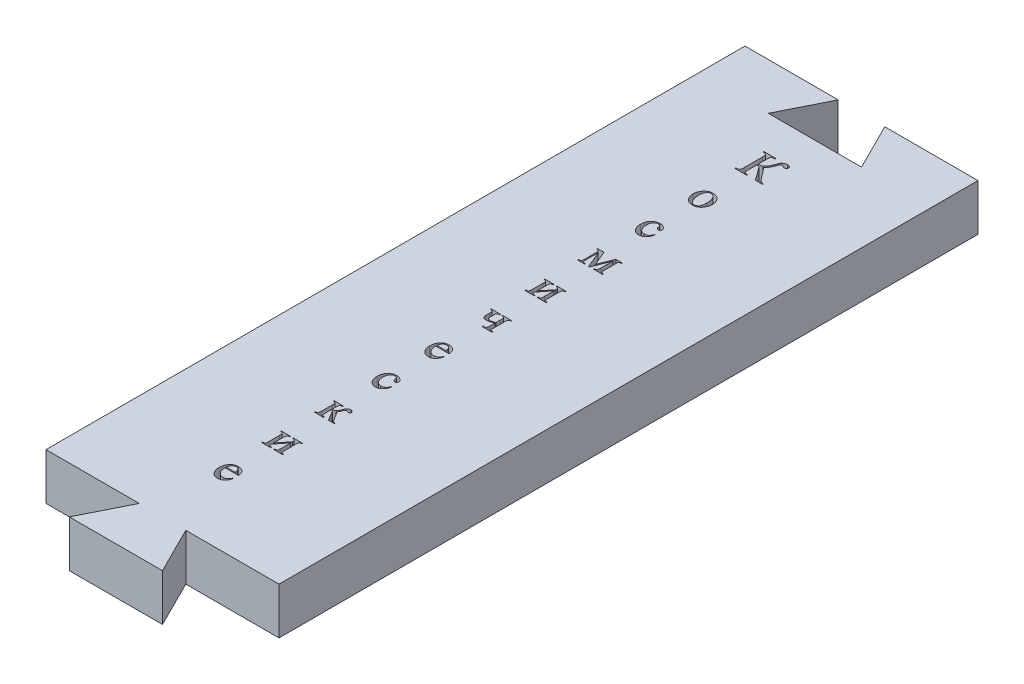
from build123d import *

# Parameters (mm, degrees)
EXTRUDE_1_DEPTH     = 4
CUT_EXTRUDE_1_DEPTH = 44.843471578


with BuildPart() as part:
    # Эскиз1 → Бобышка-Вытянуть1 (new body)
    with BuildSketch(Plane(origin=(0, 0, 0), x_dir=(1, 0, 0), z_dir=(0, 1, 0))):
        Polygon((10, 42.5), (2, 42.5), (4, 38.5), (-4, 38.5), (-2, 42.5), (-10, 42.5), (-10, -17.5), (-2, -17.5), (-4, -21.5), (4, -21.5), (2, -17.5), (10, -17.5), align=None)
    extrude(amount=EXTRUDE_1_DEPTH)

    # Эскиз2 → Вырез-Вытянуть1 (cut, through all)
    # profile 1 of 11: a face of its own
    with BuildSketch(Plane(origin=(0, 0, 0), x_dir=(1, 0, 0), z_dir=(0, 1, 0))):
        with BuildLine():
            Line((1.049034312, 33.038739172), (1.049034312, 32.970922332))
            Line((1.049034312, 32.970922332), (0.409928409, 32.970922332))
            add(Edge.make_bspline(
                [(0.409928409, 32.970922332), (0.399998569, 32.986485569), (0.378116545, 33.020781703), (0.341753386, 33.076897109), (0.297735713, 33.141966078), (0.245859188, 33.215992657), (0.188341894, 33.3003486), (0.122134611, 33.392966137), (0.049716083, 33.495522561), (-0.027542827, 33.603642333), (-0.103972856, 33.710159162), (-0.175073276, 33.807575409), (-0.238454198, 33.89183518), (-0.29306917, 33.963742247), (-0.339854656, 34.022427908), (-0.378166561, 34.068925567), (-0.408665859, 34.102508402), (-0.438584656, 34.131440362), (-0.476820499, 34.154191421), (-0.528119511, 34.172719387), (-0.58861092, 34.183679185), (-0.632054146, 34.185327141), (-0.65506725, 34.186200109)],
                knots=[0, 0, 0, 0, 0.665320115, 1.466141508, 2.409728522, 3.496282941, 4.723809894, 6.089081829, 7.59905793, 9.248429752, 10.878111518, 12.323775411, 13.594673034, 14.677919047, 15.577701261, 16.299518809, 16.848415909, 17.21275097, 17.795140309, 18.434379645, 19.17064663, 20, 20, 20, 20], degree=3))
            Line((-0.65506725, 34.186200109), (-0.65506725, 33.422311221))
            add(Edge.make_bspline(
                [(-0.65506725, 33.422311221), (-0.654820367, 33.402959084), (-0.654349415, 33.366043198), (-0.651886428, 33.313338193), (-0.646938171, 33.266287632), (-0.640783341, 33.224688219), (-0.632045681, 33.188808638), (-0.622070202, 33.158049147), (-0.609788382, 33.132896322), (-0.59494634, 33.112401728), (-0.576116061, 33.096151637), (-0.552645859, 33.082619692), (-0.52424515, 33.070680743), (-0.490605155, 33.061416118), (-0.452212337, 33.053202125), (-0.408739495, 33.046727443), (-0.359990983, 33.042632196), (-0.325755285, 33.041144866), (-0.307845028, 33.040366776)],
                knots=[0, 0, 0, 0, 1.493595992, 2.849164419, 4.069851158, 5.143678264, 6.091481437, 6.916799453, 7.63457118, 8.243076763, 8.856206194, 9.538358865, 10.326370565, 11.22739665, 12.226523072, 13.355526224, 14.616555029, 16, 16, 16, 16], degree=3))
            Line((-0.307845028, 33.040366776), (-0.307845028, 32.970922332))
            Line((-0.307845028, 32.970922332), (-1.349511695, 32.970922332))
            Line((-1.349511695, 32.970922332), (-1.349511695, 33.040366776))
            add(Edge.make_bspline(
                [(-1.349511695, 33.040366776), (-1.331964001, 33.04115149), (-1.298272367, 33.042658143), (-1.250235183, 33.046698386), (-1.20715871, 33.05330221), (-1.169040163, 33.061240641), (-1.135840974, 33.07098735), (-1.10724342, 33.081886956), (-1.084125482, 33.095869648), (-1.064417628, 33.111230295), (-1.049364995, 33.131698804), (-1.036228458, 33.156470055), (-1.025618244, 33.187248225), (-1.017401424, 33.223508235), (-1.010167906, 33.265129312), (-1.005526801, 33.312446576), (-1.00298949, 33.365497279), (-1.002530158, 33.402777003), (-1.002289473, 33.422311221)],
                knots=[0, 0, 0, 0, 1.35743264, 2.606275548, 3.723012283, 4.723512729, 5.612365058, 6.396120694, 7.079211479, 7.694772649, 8.312550924, 9.025306343, 9.856355053, 10.819049486, 11.896621444, 13.118986903, 14.490376798, 16, 16, 16, 16], degree=3))
            Line((-1.002289473, 33.422311221), (-1.002289473, 35.019533443))
            add(Edge.make_bspline(
                [(-1.002289473, 35.019533443), (-1.002528542, 35.038887024), (-1.002984588, 35.075805664), (-1.005548135, 35.128492086), (-1.010174056, 35.175631976), (-1.01734839, 35.217072974), (-1.025608496, 35.253184412), (-1.036553974, 35.283649315), (-1.048521179, 35.309173362), (-1.064103146, 35.329250195), (-1.082900743, 35.345905198), (-1.106688941, 35.35891904), (-1.134689871, 35.371220745), (-1.168170851, 35.380573064), (-1.20643521, 35.388501719), (-1.249694593, 35.395149589), (-1.29790911, 35.399205328), (-1.331782749, 35.400697111), (-1.349511695, 35.401477887)],
                knots=[0, 0, 0, 0, 1.496112215, 2.853964335, 4.076707534, 5.154612488, 6.104012402, 6.935317926, 7.654298865, 8.272268048, 8.886430403, 9.581781888, 10.358265193, 11.247392199, 12.261875648, 13.378957481, 14.628186312, 16, 16, 16, 16], degree=3))
            Line((-1.349511695, 35.401477887), (-1.349511695, 35.470922332))
            Line((-1.349511695, 35.470922332), (-0.307845028, 35.470922332))
            Line((-0.307845028, 35.470922332), (-0.307845028, 35.401477887))
            add(Edge.make_bspline(
                [(-0.307845028, 35.401477887), (-0.325755285, 35.400699797), (-0.359990983, 35.399212468), (-0.408739495, 35.395117221), (-0.452212337, 35.388642538), (-0.490605155, 35.380428545), (-0.52424515, 35.371163921), (-0.552645859, 35.359224971), (-0.576116061, 35.345693027), (-0.59494634, 35.329442935), (-0.609788382, 35.308948341), (-0.622070202, 35.283795517), (-0.632045681, 35.253036026), (-0.640783341, 35.217156444), (-0.646938171, 35.175557031), (-0.651886428, 35.12850647), (-0.654349415, 35.075801466), (-0.654820367, 35.03888558), (-0.65506725, 35.019533443)],
                knots=[0, 0, 0, 0, 1.383444971, 2.644473776, 3.773476928, 4.77260335, 5.673629435, 6.461641135, 7.143793806, 7.756923237, 8.36542882, 9.083200547, 9.908518563, 10.856321736, 11.930148842, 13.150835581, 14.506404008, 16, 16, 16, 16], degree=3))
            Line((-0.65506725, 35.019533443), (-0.65506725, 34.290366776))
            add(Edge.make_bspline(
                [(-0.65506725, 34.290366776), (-0.624493563, 34.29077679), (-0.56835474, 34.291529649), (-0.491929233, 34.296880056), (-0.430519165, 34.304351422), (-0.380993355, 34.315710422), (-0.337976928, 34.33431102), (-0.296034296, 34.360159014), (-0.251829577, 34.393907875), (-0.206219693, 34.434074819), (-0.162384355, 34.479977642), (-0.121421728, 34.527955396), (-0.085983689, 34.578169614), (-0.060313652, 34.622180491), (-0.0404603, 34.659976116), (-0.025702954, 34.693020612), (-0.009402515, 34.730157564), (0.008715203, 34.770899054), (0.026389502, 34.81661484), (0.045869047, 34.866112495), (0.066681915, 34.919867477), (0.080147395, 34.957293047), (0.08712025, 34.9766732)],
                knots=[0, 0, 0, 0, 1.651447594, 3.032356686, 4.136269876, 4.991614021, 5.766400087, 6.656036012, 7.646629067, 8.767827134, 9.935433896, 11.072437954, 12.172887607, 13.25019868, 13.82259045, 14.478288477, 15.204366537, 16.013791791, 16.886368256, 17.851488417, 18.887432249, 20, 20, 20, 20], degree=3))
            add(Edge.make_bspline(
                [(0.08712025, 34.9766732), (0.093798092, 34.994762132), (0.106640671, 35.029550095), (0.125373383, 35.079640626), (0.144278639, 35.125070028), (0.160571188, 35.166847545), (0.176852048, 35.203958237), (0.192987891, 35.236326653), (0.206489069, 35.265228801), (0.225034017, 35.297537448), (0.250275908, 35.334810714), (0.289007654, 35.374398723), (0.33504582, 35.410821788), (0.388100095, 35.443940944), (0.448100562, 35.471569969), (0.514314057, 35.491612977), (0.585985863, 35.503760492), (0.635573561, 35.505003919), (0.661121986, 35.505644554)],
                knots=[0, 0, 0, 0, 1.085064995, 2.086756748, 3.008943949, 3.853647327, 4.609994964, 5.288159394, 5.888912481, 6.403903208, 7.383485144, 8.412712235, 9.506143754, 10.680847162, 11.923953091, 13.211580717, 14.563358958, 16, 16, 16, 16], degree=3))
            add(Edge.make_bspline(
                [(0.661121986, 35.505644554), (0.683027304, 35.505013469), (0.724343777, 35.503823157), (0.782294656, 35.495306931), (0.831369514, 35.478890544), (0.87235236, 35.456966778), (0.903663033, 35.427072385), (0.926992858, 35.391292824), (0.939916633, 35.348246054), (0.941386511, 35.317648234), (0.942154972, 35.301651498)],
                knots=[0, 0, 0, 0, 1.330799491, 2.510072737, 3.541771453, 4.461485856, 5.308459524, 6.143380098, 7.029347268, 8, 8, 8, 8], degree=3))
            add(Edge.make_bspline(
                [(0.942154972, 35.301651498), (0.941649282, 35.289977298), (0.940646044, 35.266816881), (0.928834407, 35.233722962), (0.911401718, 35.202726072), (0.887032312, 35.175577189), (0.858561479, 35.153188368), (0.827914083, 35.135633458), (0.794483074, 35.125527712), (0.771502136, 35.124314532), (0.759863305, 35.123700109)],
                knots=[0, 0, 0, 0, 0.991615543, 1.967263556, 2.962233208, 4.011451814, 5.054642665, 6.042049549, 7.008384457, 8, 8, 8, 8], degree=3))
            add(Edge.make_bspline(
                [(0.759863305, 35.123700109), (0.749864731, 35.124480765), (0.726583539, 35.126298484), (0.688007175, 35.137938304), (0.640872157, 35.155415286), (0.606971363, 35.170333515), (0.588422333, 35.178496116)],
                knots=[0, 0, 0, 0, 0.663529143, 1.54499527, 2.656728901, 4, 4, 4, 4], degree=3))
            add(Edge.make_bspline(
                [(0.588422333, 35.178496116), (0.572238836, 35.185962152), (0.542900617, 35.199496938), (0.501920975, 35.214730319), (0.468995522, 35.225002752), (0.449216083, 35.227015669), (0.440852888, 35.227866776)],
                knots=[0, 0, 0, 0, 1.366667756, 2.477560721, 3.356278204, 4, 4, 4, 4], degree=3))
            add(Edge.make_bspline(
                [(0.440852888, 35.227866776), (0.431325807, 35.22715601), (0.412285497, 35.225735512), (0.385067886, 35.213226517), (0.360589903, 35.193263598), (0.342651108, 35.170362758), (0.327616936, 35.147117681), (0.31587976, 35.122428825), (0.300756909, 35.092813274), (0.285375805, 35.056732919), (0.268084519, 35.01511388), (0.248899412, 34.967621594), (0.228554131, 34.914164144), (0.21441885, 34.876491133), (0.207020423, 34.856773026)],
                knots=[0, 0, 0, 0, 0.742123004, 1.483166949, 2.298260067, 3.192918096, 3.746164378, 4.460962224, 5.327564694, 6.347210053, 7.526604023, 8.852978081, 10.352844281, 12, 12, 12, 12], degree=3))
            add(Edge.make_bspline(
                [(0.207020423, 34.856773026), (0.192507812, 34.819488749), (0.164523973, 34.74759561), (0.115951421, 34.646869623), (0.06468382, 34.556605938), (0.010452071, 34.476954368), (-0.046675309, 34.407588053), (-0.10754075, 34.349422086), (-0.171221483, 34.301033163), (-0.217059033, 34.277113289), (-0.239485653, 34.265410179)],
                knots=[0, 0, 0, 0, 1.264641413, 2.438535705, 3.532186307, 4.544077817, 5.481931357, 6.367644495, 7.201348736, 8, 8, 8, 8], degree=3))
            add(Edge.make_bspline(
                [(-0.239485653, 34.265410179), (-0.226219958, 34.260278296), (-0.196480057, 34.248773306), (-0.153181403, 34.21776105), (-0.104826962, 34.176566123), (-0.050929643, 34.124194629), (0.007087087, 34.059326701), (0.070663344, 33.983193208), (0.138956893, 33.895170521), (0.184966207, 33.831703691), (0.209190562, 33.798287783)],
                knots=[0, 0, 0, 0, 0.519729749, 1.165164097, 1.936817309, 2.851115027, 3.916574164, 5.126244434, 6.486939513, 8, 8, 8, 8], degree=3))
            add(Edge.make_bspline(
                [(0.209190562, 33.798287783), (0.234989665, 33.762435719), (0.284514469, 33.693612921), (0.356674107, 33.595409443), (0.423351327, 33.506384757), (0.484625795, 33.426597695), (0.54039846, 33.355964893), (0.590856125, 33.294792232), (0.635265733, 33.24230554), (0.675483353, 33.198166449), (0.714557141, 33.161021697), (0.754807757, 33.129208345), (0.797813895, 33.102549743), (0.843456452, 33.080856074), (0.891208704, 33.062632475), (0.941821286, 33.049786601), (0.994710149, 33.0415583), (1.03074018, 33.039688538), (1.049034312, 33.038739172)],
                knots=[0, 0, 0, 0, 1.800810373, 3.456894613, 4.96838608, 6.335460454, 7.558355655, 8.637404976, 9.568289901, 10.361372678, 11.070727478, 11.763958471, 12.449381939, 13.128710863, 13.821667333, 14.529833258, 15.253527571, 16, 16, 16, 16], degree=3))
        make_face()
    # profile 2 of 11: a face of its own
    with BuildSketch(Plane(origin=(0, 0, 0), x_dir=(1, 0, 0), z_dir=(0, 1, 0))):
        with BuildLine():
            add(Edge.make_bspline(
                [(-0.427745202, 30.186200109), (-0.39640798, 30.18544482), (-0.335052698, 30.183966035), (-0.245504448, 30.170068763), (-0.160888779, 30.147298046), (-0.081057283, 30.115479259), (-0.005406962, 30.075390763), (0.064611071, 30.024813925), (0.130452729, 29.96598669), (0.169339206, 29.92099622), (0.189116777, 29.898114172)],
                knots=[0, 0, 0, 0, 1.065475926, 2.086099963, 3.0740863, 4.040596107, 5.003967888, 5.978764027, 6.972004072, 8, 8, 8, 8], degree=3))
            add(Edge.make_bspline(
                [(0.189116777, 29.898114172), (0.204824041, 29.87737205), (0.235836973, 29.836418129), (0.27619656, 29.771293155), (0.310547036, 29.704049794), (0.338281058, 29.634056603), (0.360071135, 29.562032894), (0.375176894, 29.487554793), (0.38466272, 29.410982324), (0.385949217, 29.359043191), (0.386599416, 29.332792991)],
                knots=[0, 0, 0, 0, 1.022008931, 2.017887745, 3.006334525, 3.985540882, 4.972555944, 5.959340715, 6.968644432, 8, 8, 8, 8], degree=3))
            add(Edge.make_bspline(
                [(0.386599416, 29.332792991), (0.385139871, 29.295093716), (0.382200754, 29.219177921), (0.361184726, 29.104977995), (0.326706759, 28.990522263), (0.287589913, 28.896123024), (0.249562296, 28.823069239), (0.218675204, 28.770725769), (0.1851397, 28.721813786), (0.148698781, 28.676798894), (0.109964101, 28.635205926), (0.068581442, 28.59716348), (0.024686722, 28.562256387), (-0.037381407, 28.521463718), (-0.119351986, 28.47860252), (-0.224119836, 28.442342263), (-0.334118252, 28.418937089), (-0.409540842, 28.416568747), (-0.447818987, 28.415366776)],
                knots=[0, 0, 0, 0, 1.308834484, 2.635626516, 4.018558774, 5.454313625, 6.176211117, 6.877377291, 7.56373373, 8.233630339, 8.886803348, 9.535705325, 10.184029623, 10.831988804, 12.112861064, 13.384043246, 14.672361028, 16, 16, 16, 16], degree=3))
            add(Edge.make_bspline(
                [(-0.447818987, 28.415366776), (-0.478798324, 28.416310617), (-0.53963965, 28.418164256), (-0.628298678, 28.432544787), (-0.712340462, 28.455864999), (-0.7912986, 28.489034027), (-0.865239251, 28.532016437), (-0.934615806, 28.583667261), (-0.998587221, 28.645643465), (-1.036236989, 28.692534716), (-1.055457875, 28.716473547)],
                knots=[0, 0, 0, 0, 1.054286533, 2.07054756, 3.049048718, 4.017581598, 4.977524521, 5.954009108, 6.955484704, 8, 8, 8, 8], degree=3))
            add(Edge.make_bspline(
                [(-1.055457875, 28.716473547), (-1.070643267, 28.737760896), (-1.100660938, 28.779840593), (-1.139047354, 28.846404581), (-1.172176963, 28.914605172), (-1.198208694, 28.985115026), (-1.220202224, 29.057205868), (-1.234127389, 29.13164984), (-1.244136422, 29.207738339), (-1.244940218, 29.259155196), (-1.245345028, 29.285049936)],
                knots=[0, 0, 0, 0, 1.027995455, 2.03208656, 3.018382236, 4.006625493, 4.985712438, 5.978986255, 6.982169867, 8, 8, 8, 8], degree=3))
            add(Edge.make_bspline(
                [(-1.245345028, 29.285049936), (-1.244028144, 29.323493726), (-1.241379745, 29.400808427), (-1.218352992, 29.516041335), (-1.182521152, 29.630786515), (-1.140563592, 29.724001106), (-1.101315636, 29.79658144), (-1.068999335, 29.847976007), (-1.033911529, 29.895434109), (-0.997155307, 29.939478252), (-0.95802888, 29.979807231), (-0.916470289, 30.016164527), (-0.87327049, 30.049746856), (-0.81180766, 30.087188688), (-0.732924116, 30.127436302), (-0.633467222, 30.160943956), (-0.531599119, 30.182765126), (-0.462396652, 30.185054008), (-0.427745202, 30.186200109)],
                knots=[0, 0, 0, 0, 1.363272819, 2.741691909, 4.154573289, 5.6228479, 6.361000545, 7.082187089, 7.775412212, 8.454224844, 9.116915007, 9.76721148, 10.412930582, 11.055868397, 12.318857477, 13.54686811, 14.771653937, 16, 16, 16, 16], degree=3))
        make_face()
        with BuildLine():
            add(Edge.make_bspline(
                [(-0.484168813, 30.082033443), (-0.500505527, 30.081263844), (-0.533350464, 30.079716568), (-0.582646292, 30.068101199), (-0.631942795, 30.049665967), (-0.680945049, 30.02352236), (-0.728639055, 29.988918979), (-0.770542103, 29.941312893), (-0.807892873, 29.883251949), (-0.840294687, 29.814338059), (-0.867029695, 29.734936095), (-0.884656556, 29.644474737), (-0.896265255, 29.543960553), (-0.897484944, 29.473346346), (-0.898122806, 29.436417123)],
                knots=[0, 0, 0, 0, 0.685027346, 1.377246338, 2.114424952, 2.888451615, 3.701944125, 4.572275557, 5.532062909, 6.591086495, 7.759739625, 9.038147969, 10.451035577, 12, 12, 12, 12], degree=3))
            add(Edge.make_bspline(
                [(-0.898122806, 29.436417123), (-0.897777245, 29.405657952), (-0.897099392, 29.3453207), (-0.88965219, 29.256417146), (-0.878478387, 29.170913937), (-0.862797192, 29.088415517), (-0.84212746, 29.009272947), (-0.817179744, 28.933147628), (-0.787925322, 28.860152489), (-0.75416728, 28.791318466), (-0.716608045, 28.728224279), (-0.676142339, 28.672256888), (-0.632027844, 28.625408758), (-0.585403144, 28.58659193), (-0.535626559, 28.556212884), (-0.482606916, 28.535054447), (-0.426743632, 28.522013079), (-0.388572863, 28.520369633), (-0.369151452, 28.519533443)],
                knots=[0, 0, 0, 0, 1.268393838, 2.48808387, 3.676981921, 4.823886065, 5.949193386, 7.04838886, 8.126012347, 9.190153483, 10.207134928, 11.151496333, 12.032709656, 12.854055169, 13.647176273, 14.426997578, 15.199651256, 16, 16, 16, 16], degree=3))
            add(Edge.make_bspline(
                [(-0.369151452, 28.519533443), (-0.354656086, 28.519904063), (-0.32602914, 28.520636002), (-0.284086392, 28.527837621), (-0.244276912, 28.539899385), (-0.206293862, 28.556286764), (-0.170535149, 28.577616537), (-0.136494852, 28.60325506), (-0.104959751, 28.634147463), (-0.074937726, 28.669441308), (-0.047239315, 28.710560287), (-0.024359022, 28.758851034), (-0.004217978, 28.813269146), (0.0119406, 28.874508398), (0.02402247, 28.942408069), (0.033257055, 29.016825558), (0.038652055, 29.097976052), (0.039129, 29.154290764), (0.039377194, 29.183595943)],
                knots=[0, 0, 0, 0, 0.7925425, 1.565194785, 2.319575442, 3.064027887, 3.822549968, 4.592346092, 5.390059812, 6.232539397, 7.124410449, 8.093508243, 9.148505951, 10.295746887, 11.55331183, 12.919243719, 14.396828985, 16, 16, 16, 16], degree=3))
            add(Edge.make_bspline(
                [(0.039377194, 29.183595943), (0.038672371, 29.220682225), (0.037298566, 29.292968881), (0.028961681, 29.398336339), (0.013464504, 29.497380285), (-0.006654465, 29.590612557), (-0.03390185, 29.677698339), (-0.067073241, 29.758825809), (-0.105651368, 29.834310582), (-0.137167422, 29.879976834), (-0.152680098, 29.90245445)],
                knots=[0, 0, 0, 0, 1.176782824, 2.293723966, 3.350316679, 4.355440551, 5.317295722, 6.24112299, 7.134254284, 8, 8, 8, 8], degree=3))
            add(Edge.make_bspline(
                [(-0.152680098, 29.90245445), (-0.163573769, 29.916832302), (-0.184749788, 29.94478116), (-0.221092147, 29.981236502), (-0.259058633, 30.012794679), (-0.300074812, 30.037553093), (-0.342893645, 30.057639322), (-0.388018785, 30.071449361), (-0.435323239, 30.080743103), (-0.467665947, 30.081597491), (-0.484168813, 30.082033443)],
                knots=[0, 0, 0, 0, 1.101841247, 2.141850159, 3.140102416, 4.113043798, 5.063027868, 6.02484522, 6.992177371, 8, 8, 8, 8], degree=3))
        make_face(mode=Mode.SUBTRACT)
    # profile 3 of 11: a face of its own
    with BuildSketch(Plane(origin=(0, 0, 0), x_dir=(1, 0, 0), z_dir=(0, 1, 0))):
        with BuildLine():
            add(Edge.make_bspline(
                [(0.178266083, 24.598743512), (0.172351762, 24.56988869), (0.160838678, 24.513718596), (0.137086539, 24.433205702), (0.110213864, 24.357983257), (0.078857329, 24.288368288), (0.042992465, 24.224690826), (0.00316549, 24.16681469), (-0.040344006, 24.114252059), (-0.088009596, 24.06775313), (-0.138583154, 24.027331936), (-0.190264554, 23.991628129), (-0.243545361, 23.961810945), (-0.298113726, 23.937089375), (-0.354107153, 23.918108115), (-0.411486518, 23.904465106), (-0.47017625, 23.896083858), (-0.509821632, 23.895051938), (-0.52974173, 23.894533443)],
                knots=[0, 0, 0, 0, 1.297413908, 2.525604275, 3.695291166, 4.815162201, 5.885657823, 6.91131488, 7.907158975, 8.887708176, 9.839801015, 10.757107347, 11.652659607, 12.526533963, 13.393440414, 14.25358095, 15.122499594, 16, 16, 16, 16], degree=3))
            add(Edge.make_bspline(
                [(-0.52974173, 23.894533443), (-0.553300778, 23.895244227), (-0.60015398, 23.896657802), (-0.669056253, 23.908571733), (-0.735798216, 23.926776474), (-0.799893428, 23.953400673), (-0.861907617, 23.986950688), (-0.921183921, 24.028750205), (-0.97844861, 24.077333319), (-1.03294047, 24.132767075), (-1.082812829, 24.19495976), (-1.126165546, 24.26311545), (-1.163538875, 24.336163293), (-1.19296362, 24.414985829), (-1.217345477, 24.498444067), (-1.232850374, 24.587630312), (-1.243798848, 24.681478786), (-1.244821918, 24.745916924), (-1.245345028, 24.77886504)],
                knots=[0, 0, 0, 0, 0.890668714, 1.771322916, 2.637778568, 3.502963856, 4.39076398, 5.299845053, 6.241524136, 7.228440153, 8.235983923, 9.251301994, 10.279332793, 11.333905469, 12.429638549, 13.563514598, 14.754191131, 16, 16, 16, 16], degree=3))
            add(Edge.make_bspline(
                [(-1.245345028, 24.77886504), (-1.244612751, 24.810908508), (-1.243176966, 24.873736586), (-1.23201637, 24.965541876), (-1.214595795, 25.053111596), (-1.188101022, 25.135519226), (-1.155692076, 25.213916534), (-1.11531483, 25.287285834), (-1.067785051, 25.356256989), (-1.013335859, 25.419643116), (-0.953703811, 25.476941383), (-0.890984528, 25.527699928), (-0.824830529, 25.570163645), (-0.756166823, 25.605500059), (-0.684004327, 25.631767754), (-0.60947619, 25.651675818), (-0.531731037, 25.663233571), (-0.478961831, 25.664648238), (-0.452159264, 25.665366776)],
                knots=[0, 0, 0, 0, 1.157560076, 2.269644319, 3.337216041, 4.378852448, 5.392248998, 6.398286675, 7.398876377, 8.41387294, 9.412133972, 10.383708611, 11.324467174, 12.247977359, 13.168082608, 14.093740467, 15.031771529, 16, 16, 16, 16], degree=3))
            add(Edge.make_bspline(
                [(-0.452159264, 25.665366776), (-0.432254683, 25.664904024), (-0.393079057, 25.66399325), (-0.33569566, 25.658202696), (-0.281001699, 25.64759594), (-0.22890375, 25.633908268), (-0.179828936, 25.615146125), (-0.133259934, 25.592824546), (-0.089414951, 25.566368696), (-0.049052584, 25.53598945), (-0.012514853, 25.50376966), (0.01973724, 25.470679227), (0.046919299, 25.437029457), (0.069386112, 25.403303895), (0.087213605, 25.36923505), (0.09977561, 25.334595255), (0.106944981, 25.299445713), (0.108199677, 25.276037318), (0.108821638, 25.264433616)],
                knots=[0, 0, 0, 0, 1.263797997, 2.48737088, 3.656059641, 4.797991223, 5.902603087, 6.986129184, 8.073056493, 9.147725862, 10.188938861, 11.163310398, 12.077801781, 12.931224444, 13.732299697, 14.513125037, 15.262945949, 16, 16, 16, 16], degree=3))
            add(Edge.make_bspline(
                [(0.108821638, 25.264433616), (0.108309025, 25.253541384), (0.107311035, 25.232335686), (0.099321532, 25.20194651), (0.084452131, 25.175403102), (0.065581841, 25.151818297), (0.04153483, 25.132410533), (0.012138165, 25.119446756), (-0.02111285, 25.111168865), (-0.044842911, 25.110275961), (-0.057193987, 25.109811221)],
                knots=[0, 0, 0, 0, 1.021026571, 1.987800029, 2.913544594, 3.853776469, 4.80722068, 5.778445921, 6.843720538, 8, 8, 8, 8], degree=3))
            add(Edge.make_bspline(
                [(-0.057193987, 25.109811221), (-0.073412404, 25.110445818), (-0.103635574, 25.111628396), (-0.144879708, 25.125372442), (-0.178038369, 25.148798592), (-0.191507657, 25.170900037), (-0.198253014, 25.181968339)],
                knots=[0, 0, 0, 0, 1.159180601, 2.160143682, 3.07860844, 4, 4, 4, 4], degree=3))
            add(Edge.make_bspline(
                [(-0.198253014, 25.181968339), (-0.206014518, 25.189732624), (-0.222539165, 25.206263192), (-0.237818404, 25.241587087), (-0.250828624, 25.284031721), (-0.255500847, 25.333798594), (-0.262095699, 25.384668713), (-0.276789353, 25.431594389), (-0.298247898, 25.472167958), (-0.318213147, 25.493744839), (-0.327918813, 25.504233964)],
                knots=[0, 0, 0, 0, 0.73568264, 1.566306662, 2.559961987, 3.731587317, 4.930920428, 6.020676496, 7.037795534, 8, 8, 8, 8], degree=3))
            add(Edge.make_bspline(
                [(-0.327918813, 25.504233964), (-0.338968143, 25.513098811), (-0.361623841, 25.531275416), (-0.403316011, 25.548713898), (-0.450380111, 25.559054487), (-0.483565829, 25.560461479), (-0.500987389, 25.561200109)],
                knots=[0, 0, 0, 0, 0.908906272, 1.863633872, 2.878468384, 4, 4, 4, 4], degree=3))
            add(Edge.make_bspline(
                [(-0.500987389, 25.561200109), (-0.515471713, 25.560741518), (-0.54384218, 25.559843275), (-0.585614084, 25.55399383), (-0.625036659, 25.543044095), (-0.662265885, 25.528220402), (-0.697613791, 25.509874218), (-0.72995962, 25.485923343), (-0.761388926, 25.459189377), (-0.779402443, 25.437954703), (-0.788530792, 25.427194033)],
                knots=[0, 0, 0, 0, 1.057854736, 2.072021611, 3.071637771, 4.037894383, 4.994991958, 5.969874429, 6.971233904, 8, 8, 8, 8], degree=3))
            add(Edge.make_bspline(
                [(-0.788530792, 25.427194033), (-0.800081289, 25.412051889), (-0.823343423, 25.381556354), (-0.852274665, 25.331257225), (-0.877576026, 25.278053445), (-0.897423759, 25.220809949), (-0.914101894, 25.160402118), (-0.924202577, 25.095953977), (-0.931905273, 25.028435425), (-0.932526608, 24.982159404), (-0.932845028, 24.958444033)],
                knots=[0, 0, 0, 0, 0.912975283, 1.838687419, 2.778126519, 3.736020828, 4.742185531, 5.780758422, 6.862690979, 8, 8, 8, 8], degree=3))
            add(Edge.make_bspline(
                [(-0.932845028, 24.958444033), (-0.932484432, 24.934012211), (-0.931775015, 24.88594648), (-0.924465715, 24.814870903), (-0.912549876, 24.746010196), (-0.896170327, 24.679152976), (-0.875965999, 24.614280548), (-0.849312328, 24.5522298), (-0.819018112, 24.491988863), (-0.784853766, 24.434238947), (-0.746230139, 24.381297484), (-0.703751029, 24.33498748), (-0.658415686, 24.295146877), (-0.609216032, 24.26298514), (-0.556680277, 24.237798764), (-0.500899148, 24.219676764), (-0.44168592, 24.209397697), (-0.401199745, 24.207832148), (-0.380544681, 24.207033443)],
                knots=[0, 0, 0, 0, 1.130902598, 2.224871355, 3.30412845, 4.364246172, 5.410248778, 6.445978872, 7.487009444, 8.530999214, 9.549251986, 10.515244125, 11.435287877, 12.336389788, 13.227751885, 14.125423687, 15.043636656, 16, 16, 16, 16], degree=3))
            add(Edge.make_bspline(
                [(-0.380544681, 24.207033443), (-0.350955769, 24.208267685), (-0.29277617, 24.21069453), (-0.208010147, 24.230484594), (-0.127563224, 24.262366093), (-0.078997399, 24.293376088), (-0.054481313, 24.309029971)],
                knots=[0, 0, 0, 0, 1.022524589, 2.010552832, 2.995724694, 4, 4, 4, 4], degree=3))
            add(Edge.make_bspline(
                [(-0.054481313, 24.309029971), (-0.04579119, 24.316429976), (-0.027632167, 24.331893149), (-0.003069808, 24.360154662), (0.02229935, 24.392311458), (0.046685265, 24.429589737), (0.071519343, 24.471293203), (0.095509966, 24.517873275), (0.120144352, 24.56898421), (0.135549989, 24.605007756), (0.143543861, 24.623700109)],
                knots=[0, 0, 0, 0, 0.729264717, 1.523883557, 2.389456303, 3.348913118, 4.370795846, 5.493782051, 6.699541924, 8, 8, 8, 8], degree=3))
            Line((0.143543861, 24.623700109), (0.178266083, 24.598743512))
        make_face()
    # profile 4 of 11: a face of its own
    with BuildSketch(Plane(origin=(0, 0, 0), x_dir=(1, 0, 0), z_dir=(0, 1, 0))):
        with BuildLine():
            Line((-0.18631725, 19.852215734), (0.316069902, 21.109811221))
            Line((0.316069902, 21.109811221), (0.872710527, 21.109811221))
            Line((0.872710527, 21.109811221), (0.872710527, 21.040366776))
            add(Edge.make_bspline(
                [(0.872710527, 21.040366776), (0.85461807, 21.040056426), (0.821626064, 21.039490495), (0.77689442, 21.035573369), (0.741746865, 21.028540288), (0.708492575, 21.01537941), (0.679281706, 20.990884734), (0.656616603, 20.966483215), (0.64596759, 20.944833069), (0.642385849, 20.928112576), (0.637471406, 20.907127919), (0.635627268, 20.880664485), (0.63242735, 20.849638603), (0.631189443, 20.813410205), (0.630019524, 20.772363042), (0.629780924, 20.743240187), (0.629654972, 20.727866776)],
                knots=[0, 0, 0, 0, 1.584210393, 2.888843606, 3.926246297, 4.714344826, 5.990707065, 7.227458523, 7.595770758, 8.087420743, 8.717843885, 9.482035482, 10.403870704, 11.450058471, 12.653933574, 14, 14, 14, 14], degree=3))
            Line((0.629654972, 20.727866776), (0.629654972, 19.790366776))
            add(Edge.make_bspline(
                [(0.629654972, 19.790366776), (0.629791643, 19.76504559), (0.630037795, 19.719440479), (0.633308993, 19.658235459), (0.637586969, 19.611820718), (0.643942397, 19.577327852), (0.655999429, 19.552582592), (0.670989795, 19.532162263), (0.691017676, 19.515594047), (0.715020221, 19.500757996), (0.745296477, 19.490112524), (0.781801148, 19.482872634), (0.825057724, 19.478778099), (0.856064009, 19.478185128), (0.872710527, 19.477866776)],
                knots=[0, 0, 0, 0, 1.89883269, 3.419921858, 4.592597875, 5.398692772, 6.029567283, 6.639844093, 7.284132226, 7.965599562, 8.746546658, 9.674805619, 10.7516598, 12, 12, 12, 12], degree=3))
            Line((0.872710527, 19.477866776), (0.872710527, 19.408422332))
            Line((0.872710527, 19.408422332), (0.074099416, 19.408422332))
            Line((0.074099416, 19.408422332), (0.074099416, 19.477866776))
            add(Edge.make_bspline(
                [(0.074099416, 19.477866776), (0.096195712, 19.47857296), (0.136697471, 19.479867372), (0.19221742, 19.489454649), (0.236007314, 19.506941251), (0.265027331, 19.528485525), (0.280203881, 19.551972887), (0.290629201, 19.573722585), (0.29831504, 19.600949705), (0.305331415, 19.632623785), (0.310711197, 19.669434411), (0.31415959, 19.711289817), (0.317199799, 19.758134158), (0.317170338, 19.791084282), (0.317154972, 19.808270422)],
                knots=[0, 0, 0, 0, 1.625657435, 2.979774898, 4.118732321, 5.074434181, 5.572549054, 6.161656211, 6.843371231, 7.647085973, 8.548272169, 9.576841231, 10.736127784, 12, 12, 12, 12], degree=3))
            Line((0.317154972, 19.808270422), (0.317154972, 20.830948373))
            Line((0.317154972, 20.830948373), (-0.251421417, 19.408422332))
            Line((-0.251421417, 19.408422332), (-0.331174021, 19.408422332))
            Line((-0.331174021, 19.408422332), (-0.932845028, 20.830948373))
            Line((-0.932845028, 20.830948373), (-0.932845028, 19.808270422))
            add(Edge.make_bspline(
                [(-0.932845028, 19.808270422), (-0.932686367, 19.781503013), (-0.932399983, 19.733187787), (-0.929351057, 19.668347667), (-0.924547323, 19.619174398), (-0.917418183, 19.583041086), (-0.905481534, 19.556938988), (-0.890466136, 19.535691886), (-0.871150789, 19.517554589), (-0.84706398, 19.502580949), (-0.817143595, 19.491007795), (-0.780712607, 19.483446644), (-0.737481389, 19.478600652), (-0.706442894, 19.478123036), (-0.689789473, 19.477866776)],
                knots=[0, 0, 0, 0, 1.946796178, 3.513970871, 4.718083299, 5.541265373, 6.176970242, 6.790095182, 7.422799497, 8.090621271, 8.840447796, 9.743502185, 10.789296712, 12, 12, 12, 12], degree=3))
            Line((-0.689789473, 19.477866776), (-0.689789473, 19.408422332))
            Line((-0.689789473, 19.408422332), (-1.28006725, 19.408422332))
            Line((-1.28006725, 19.408422332), (-1.28006725, 19.477866776))
            add(Edge.make_bspline(
                [(-1.28006725, 19.477866776), (-1.267583942, 19.478096371), (-1.243852057, 19.478532852), (-1.210146537, 19.481192997), (-1.180057485, 19.485514481), (-1.153253753, 19.491234342), (-1.129921178, 19.499274691), (-1.11008251, 19.509160118), (-1.093260702, 19.52033634), (-1.08037874, 19.534755013), (-1.069454851, 19.551856159), (-1.061362173, 19.573214689), (-1.053602954, 19.598550804), (-1.047247706, 19.628309297), (-1.042453234, 19.662573678), (-1.039463593, 19.701350299), (-1.037127875, 19.744403986), (-1.037051474, 19.77462948), (-1.037011695, 19.790366776)],
                knots=[0, 0, 0, 0, 1.258720138, 2.392939594, 3.406399757, 4.322135718, 5.152563947, 5.886494953, 6.554242216, 7.173684194, 7.821207301, 8.589879974, 9.46666201, 10.493161759, 11.65360857, 12.952884252, 14.413479575, 16, 16, 16, 16], degree=3))
            Line((-1.037011695, 19.790366776), (-1.037011695, 20.727866776))
            add(Edge.make_bspline(
                [(-1.037011695, 20.727866776), (-1.037218788, 20.742876071), (-1.037608027, 20.771086592), (-1.037765408, 20.811075541), (-1.039542395, 20.846159718), (-1.041567633, 20.876568401), (-1.044297895, 20.902074758), (-1.047149178, 20.922861762), (-1.051481825, 20.938602778), (-1.05986329, 20.960157893), (-1.081146899, 20.985738053), (-1.109919104, 21.011186118), (-1.143568935, 21.026734698), (-1.180060662, 21.034488065), (-1.226556259, 21.039884729), (-1.261056493, 21.04019552), (-1.28006725, 21.040366776)],
                knots=[0, 0, 0, 0, 1.314696702, 2.471020776, 3.501623745, 4.390843428, 5.139456742, 5.748778688, 6.225253835, 6.566427069, 7.767028271, 9.083155287, 9.905083976, 10.980708293, 12.336271514, 14, 14, 14, 14], degree=3))
            Line((-1.28006725, 21.040366776), (-1.28006725, 21.109811221))
            Line((-1.28006725, 21.109811221), (-0.718001278, 21.109811221))
            Line((-0.718001278, 21.109811221), (-0.18631725, 19.852215734))
        make_face()
    # profile 5 of 11: a face of its own
    with BuildSketch(Plane(origin=(0, 0, 0), x_dir=(1, 0, 0), z_dir=(0, 1, 0))):
        with BuildLine():
            Line((-0.724511695, 15.373700109), (0.004654972, 16.276477887))
            add(Edge.make_bspline(
                [(0.004654972, 16.276477887), (0.003594177, 16.297331733), (0.001620686, 16.336127979), (-0.009305896, 16.389250936), (-0.026985603, 16.432370745), (-0.051885604, 16.46608414), (-0.08571816, 16.490732069), (-0.12860798, 16.506693438), (-0.180340507, 16.517800776), (-0.218074282, 16.518926852), (-0.238400584, 16.519533443)],
                knots=[0, 0, 0, 0, 1.25603524, 2.336712915, 3.248901739, 4.041614774, 4.827794657, 5.731626579, 6.778080301, 8, 8, 8, 8], degree=3))
            Line((-0.238400584, 16.519533443), (-0.238400584, 16.588977887))
            Line((-0.238400584, 16.588977887), (0.560210527, 16.588977887))
            Line((0.560210527, 16.588977887), (0.560210527, 16.519533443))
            add(Edge.make_bspline(
                [(0.560210527, 16.519533443), (0.542296949, 16.519229673), (0.509662253, 16.51867627), (0.465313468, 16.514681478), (0.430304858, 16.507745161), (0.396901055, 16.49430988), (0.366837638, 16.470455895), (0.344126234, 16.44563706), (0.333465794, 16.424002128), (0.329886553, 16.407278306), (0.324971151, 16.386294926), (0.323127358, 16.359831031), (0.31992732, 16.32880531), (0.318689453, 16.292576859), (0.317519521, 16.251529712), (0.317280923, 16.222406855), (0.317154972, 16.207033443)],
                knots=[0, 0, 0, 0, 1.569088529, 2.858542623, 3.896412245, 4.684865494, 5.987102112, 7.224410228, 7.592888239, 8.084759514, 8.715466407, 9.480001963, 10.4022521, 11.448910752, 12.653327714, 14, 14, 14, 14], degree=3))
            Line((0.317154972, 16.207033443), (0.317154972, 15.269533443))
            add(Edge.make_bspline(
                [(0.317154972, 15.269533443), (0.31736334, 15.25488579), (0.317759501, 15.227036933), (0.317897828, 15.18759075), (0.319692756, 15.152685341), (0.321745116, 15.122467777), (0.324339656, 15.096929029), (0.327588915, 15.076102209), (0.331018947, 15.059839387), (0.339361091, 15.037628732), (0.361375564, 15.011705367), (0.390370578, 14.985835008), (0.424346621, 14.969909121), (0.461048896, 14.963281624), (0.507214319, 14.957394988), (0.541371165, 14.957161967), (0.560210527, 14.957033443)],
                knots=[0, 0, 0, 0, 1.282707916, 2.438748994, 3.453282145, 4.342284203, 5.090714305, 5.699887127, 6.187688219, 6.543528699, 7.765983447, 9.10408532, 9.925812853, 11.013000354, 12.352506862, 14, 14, 14, 14], degree=3))
            Line((0.560210527, 14.957033443), (0.560210527, 14.887588998))
            Line((0.560210527, 14.887588998), (-0.238400584, 14.887588998))
            Line((-0.238400584, 14.887588998), (-0.238400584, 14.957033443))
            add(Edge.make_bspline(
                [(-0.238400584, 14.957033443), (-0.216101727, 14.95746092), (-0.175193379, 14.958245149), (-0.119912253, 14.968415045), (-0.075785524, 14.983888546), (-0.047337496, 15.004570495), (-0.03159282, 15.026572323), (-0.022135965, 15.047699909), (-0.013560929, 15.073114978), (-0.006441711, 15.103235928), (-0.002029708, 15.138163315), (0.001722222, 15.177785847), (0.004684739, 15.22210981), (0.004665191, 15.253252031), (0.004654972, 15.269533443)],
                knots=[0, 0, 0, 0, 1.690346571, 3.101023719, 4.248137943, 5.217279308, 5.708751061, 6.285910337, 6.967405867, 7.743156262, 8.630285284, 9.636903878, 10.764553721, 12, 12, 12, 12], degree=3))
            Line((0.004654972, 15.269533443), (0.004654972, 16.102866776))
            Line((0.004654972, 16.102866776), (-0.724511695, 15.200088998))
            add(Edge.make_bspline(
                [(-0.724511695, 15.200088998), (-0.723349623, 15.178889111), (-0.721210562, 15.139865848), (-0.711713765, 15.086507073), (-0.697564958, 15.043591432), (-0.677657092, 15.008467721), (-0.644960682, 14.98433207), (-0.601257036, 14.968771057), (-0.54553906, 14.958915744), (-0.504110386, 14.957698864), (-0.481456139, 14.957033443)],
                knots=[0, 0, 0, 0, 1.25704126, 2.313873185, 3.198075723, 3.929341958, 4.662175754, 5.547415936, 6.658865039, 8, 8, 8, 8], degree=3))
            Line((-0.481456139, 14.957033443), (-0.481456139, 14.887588998))
            Line((-0.481456139, 14.887588998), (-1.28006725, 14.887588998))
            Line((-1.28006725, 14.887588998), (-1.28006725, 14.957033443))
            add(Edge.make_bspline(
                [(-1.28006725, 14.957033443), (-1.267583942, 14.957263038), (-1.243852057, 14.957699519), (-1.210146537, 14.960359664), (-1.180057485, 14.964681148), (-1.153253753, 14.970401009), (-1.129921178, 14.978441358), (-1.11008251, 14.988326785), (-1.093260702, 14.999503007), (-1.08037874, 15.01392168), (-1.069454851, 15.031022826), (-1.061362173, 15.052381356), (-1.053602954, 15.07771747), (-1.047247706, 15.107475963), (-1.042453234, 15.141740344), (-1.039463593, 15.180516966), (-1.037127875, 15.223570653), (-1.037051474, 15.253796147), (-1.037011695, 15.269533443)],
                knots=[0, 0, 0, 0, 1.258720138, 2.392939594, 3.406399757, 4.322135718, 5.152563947, 5.886494953, 6.554242216, 7.173684194, 7.821207301, 8.589879974, 9.46666201, 10.493161759, 11.65360857, 12.952884252, 14.413479575, 16, 16, 16, 16], degree=3))
            Line((-1.037011695, 15.269533443), (-1.037011695, 16.185874589))
            add(Edge.make_bspline(
                [(-1.037011695, 16.185874589), (-1.037220555, 16.201788118), (-1.037616918, 16.23198788), (-1.037749333, 16.274688833), (-1.039554534, 16.31230349), (-1.041559466, 16.344701576), (-1.044278831, 16.371835482), (-1.047159602, 16.393879334), (-1.051554082, 16.41067268), (-1.059566103, 16.433730085), (-1.081055787, 16.461003701), (-1.109684986, 16.488356765), (-1.143347555, 16.505531402), (-1.180009212, 16.513769167), (-1.22655897, 16.519010045), (-1.261057456, 16.519347496), (-1.28006725, 16.519533443)],
                knots=[0, 0, 0, 0, 1.341186991, 2.545225849, 3.597763913, 4.514180269, 5.279969602, 5.896380446, 6.384291384, 6.741045424, 7.945855608, 9.251949869, 10.056200149, 11.094855542, 12.399170382, 14, 14, 14, 14], degree=3))
            Line((-1.28006725, 16.519533443), (-1.28006725, 16.588977887))
            Line((-1.28006725, 16.588977887), (-0.481456139, 16.588977887))
            Line((-0.481456139, 16.588977887), (-0.481456139, 16.519533443))
            add(Edge.make_bspline(
                [(-0.481456139, 16.519533443), (-0.499369718, 16.519229673), (-0.532004414, 16.51867627), (-0.576353199, 16.514681478), (-0.611361809, 16.507745161), (-0.644765612, 16.49430988), (-0.674829028, 16.470455895), (-0.697540432, 16.44563706), (-0.708200873, 16.424002128), (-0.711780114, 16.407278306), (-0.716695516, 16.386294926), (-0.718539309, 16.359831031), (-0.721739347, 16.32880531), (-0.722977214, 16.292576859), (-0.724147146, 16.251529712), (-0.724385744, 16.222406855), (-0.724511695, 16.207033443)],
                knots=[0, 0, 0, 0, 1.569088529, 2.858542623, 3.896412245, 4.684865494, 5.987102112, 7.224410228, 7.592888239, 8.084759514, 8.715466407, 9.480001963, 10.4022521, 11.448910752, 12.653327714, 14, 14, 14, 14], degree=3))
            Line((-0.724511695, 16.207033443), (-0.724511695, 15.373700109))
        make_face()
    # profile 6 of 11: a face of its own
    with BuildSketch(Plane(origin=(0, 0, 0), x_dir=(1, 0, 0), z_dir=(0, 1, 0))):
        with BuildLine():
            Line((-0.134233917, 11.269533443), (-0.134233917, 11.652562957))
            add(Edge.make_bspline(
                [(-0.134233917, 11.652562957), (-0.134112411, 11.667394211), (-0.133881214, 11.695614657), (-0.135437405, 11.735928095), (-0.135972313, 11.772138385), (-0.138490848, 11.804121778), (-0.140540162, 11.831986963), (-0.142836357, 11.855807826), (-0.146995817, 11.875412457), (-0.151387926, 11.896095849), (-0.16117065, 11.917347602), (-0.175855321, 11.939878923), (-0.195835895, 11.95845563), (-0.220579814, 11.973470071), (-0.250789562, 11.984689636), (-0.286971658, 11.993437132), (-0.329982433, 11.997852249), (-0.360824959, 11.998405024), (-0.377289473, 11.998700109)],
                knots=[0, 0, 0, 0, 1.395578756, 2.655463383, 3.796261267, 4.802702251, 5.673349754, 6.427016397, 7.051184599, 7.558917727, 8.412599121, 9.23394341, 10.076697231, 10.955292993, 11.941382116, 13.097188654, 14.450406583, 16, 16, 16, 16], degree=3))
            Line((-0.377289473, 11.998700109), (-0.377289473, 12.068144554))
            Line((-0.377289473, 12.068144554), (0.421321638, 12.068144554))
            Line((0.421321638, 12.068144554), (0.421321638, 11.998700109))
            add(Edge.make_bspline(
                [(0.421321638, 11.998700109), (0.403229181, 11.998389759), (0.370237176, 11.997823828), (0.325505531, 11.993906702), (0.290357977, 11.986873621), (0.257103686, 11.973712743), (0.227892817, 11.949218067), (0.205227714, 11.924816548), (0.194578701, 11.903166402), (0.19099696, 11.886445909), (0.186082518, 11.865461253), (0.184238379, 11.838997819), (0.181038461, 11.807971937), (0.179800554, 11.771743539), (0.178630635, 11.730696375), (0.178392035, 11.70157352), (0.178266083, 11.686200109)],
                knots=[0, 0, 0, 0, 1.584210393, 2.888843606, 3.926246297, 4.714344826, 5.990707065, 7.227458523, 7.595770758, 8.087420743, 8.717843885, 9.482035482, 10.403870704, 11.450058471, 12.653933574, 14, 14, 14, 14], degree=3))
            Line((0.178266083, 11.686200109), (0.178266083, 10.748700109))
            add(Edge.make_bspline(
                [(0.178266083, 10.748700109), (0.178402754, 10.723378924), (0.178648907, 10.677773812), (0.181920104, 10.616568792), (0.18619808, 10.570154052), (0.192553508, 10.535661186), (0.20461054, 10.510915926), (0.219600906, 10.490495596), (0.239628788, 10.47392738), (0.263631332, 10.459091329), (0.293907588, 10.448445857), (0.330412259, 10.441205967), (0.373668835, 10.437111432), (0.40467512, 10.436518461), (0.421321638, 10.436200109)],
                knots=[0, 0, 0, 0, 1.89883269, 3.419921858, 4.592597875, 5.398692772, 6.029567283, 6.639844093, 7.284132226, 7.965599562, 8.746546658, 9.674805619, 10.7516598, 12, 12, 12, 12], degree=3))
            Line((0.421321638, 10.436200109), (0.421321638, 10.366755665))
            Line((0.421321638, 10.366755665), (-0.446733917, 10.366755665))
            Line((-0.446733917, 10.366755665), (-0.446733917, 10.436200109))
            add(Edge.make_bspline(
                [(-0.446733917, 10.436200109), (-0.422854703, 10.437117766), (-0.379765058, 10.438773663), (-0.321868723, 10.443203607), (-0.277666925, 10.447679122), (-0.244530118, 10.453078619), (-0.219413085, 10.463125107), (-0.198189341, 10.477636991), (-0.179861799, 10.497748709), (-0.162186865, 10.523610797), (-0.148491842, 10.560501566), (-0.140670617, 10.61061838), (-0.13452057, 10.674765269), (-0.13433567, 10.722455525), (-0.134233917, 10.748700109)],
                knots=[0, 0, 0, 0, 1.58916153, 2.867615645, 3.859726013, 4.546090497, 5.091020096, 5.644770243, 6.240303688, 6.89074611, 7.717094003, 8.830455849, 10.255757524, 12, 12, 12, 12], degree=3))
            Line((-0.134233917, 10.748700109), (-0.134233917, 11.165366776))
            add(Edge.make_bspline(
                [(-0.134233917, 11.165366776), (-0.157081361, 11.154254182), (-0.202402024, 11.132211011), (-0.272317808, 11.103859571), (-0.343060358, 11.080244026), (-0.414713145, 11.060363851), (-0.487228224, 11.045320419), (-0.560765641, 11.03443643), (-0.63522914, 11.02771332), (-0.685254484, 11.026891217), (-0.710405792, 11.026477887)],
                knots=[0, 0, 0, 0, 1.019102093, 2.021512046, 3.02415829, 4.009860461, 5.003090739, 5.993268796, 6.99107309, 8, 8, 8, 8], degree=3))
            add(Edge.make_bspline(
                [(-0.710405792, 11.026477887), (-0.736464983, 11.02695978), (-0.785652744, 11.027869372), (-0.854842572, 11.035527698), (-0.914676167, 11.04968843), (-0.965538877, 11.068244857), (-1.006998685, 11.091455202), (-1.04095586, 11.11567002), (-1.06643036, 11.142245538), (-1.084453357, 11.172226228), (-1.094008088, 11.207989353), (-1.101634265, 11.250420227), (-1.105519891, 11.301841276), (-1.106127585, 11.338975017), (-1.106456139, 11.359051672)],
                knots=[0, 0, 0, 0, 1.541197496, 2.909071693, 4.107679515, 5.170550917, 6.099345842, 6.910151874, 7.629036517, 8.261929405, 8.955542304, 9.80318726, 10.812275544, 12, 12, 12, 12], degree=3))
            Line((-1.106456139, 11.359051672), (-1.106456139, 11.686200109))
            add(Edge.make_bspline(
                [(-1.106456139, 11.686200109), (-1.106686938, 11.710252985), (-1.107103597, 11.753675597), (-1.109389819, 11.812188301), (-1.114047944, 11.857142387), (-1.120045338, 11.890944413), (-1.130444916, 11.916927273), (-1.146420365, 11.937592381), (-1.165976731, 11.956530575), (-1.191310568, 11.971665078), (-1.221813307, 11.984607002), (-1.258955001, 11.992475085), (-1.302135359, 11.99813526), (-1.333030586, 11.998503612), (-1.349511695, 11.998700109)],
                knots=[0, 0, 0, 0, 1.815215665, 3.277005423, 4.416320596, 5.22459213, 5.860738943, 6.504886086, 7.180638685, 7.903913532, 8.717467193, 9.670784336, 10.757476083, 12, 12, 12, 12], degree=3))
            Line((-1.349511695, 11.998700109), (-1.349511695, 12.068144554))
            Line((-1.349511695, 12.068144554), (-0.550900584, 12.068144554))
            Line((-0.550900584, 12.068144554), (-0.550900584, 11.998700109))
            add(Edge.make_bspline(
                [(-0.550900584, 11.998700109), (-0.568821619, 11.998464668), (-0.601488783, 11.998035496), (-0.645813296, 11.993274346), (-0.681002112, 11.986030874), (-0.714576758, 11.970924422), (-0.744381197, 11.944562842), (-0.767222333, 11.917720668), (-0.777582226, 11.894427242), (-0.781328869, 11.87633893), (-0.7861317, 11.853320096), (-0.78793855, 11.824529775), (-0.791241361, 11.790609073), (-0.792388776, 11.751306401), (-0.793605793, 11.706462946), (-0.793834573, 11.674808495), (-0.793956139, 11.657988304)],
                knots=[0, 0, 0, 0, 1.49187663, 2.719451086, 3.709577258, 4.471241857, 5.75571593, 6.990936603, 7.368703353, 7.865539122, 8.524342613, 9.326202208, 10.263111987, 11.363606019, 12.599102175, 14, 14, 14, 14], degree=3))
            Line((-0.793956139, 11.657988304), (-0.793956139, 11.44043188))
            add(Edge.make_bspline(
                [(-0.793956139, 11.44043188), (-0.793774947, 11.42108005), (-0.793442728, 11.385598119), (-0.790525264, 11.337528275), (-0.785258599, 11.299615606), (-0.778354436, 11.269898724), (-0.765151246, 11.246835088), (-0.746894638, 11.227441973), (-0.723452148, 11.20966277), (-0.694108094, 11.193755963), (-0.658705705, 11.180837256), (-0.616712397, 11.172004117), (-0.568443264, 11.165831202), (-0.533924107, 11.165527616), (-0.515635827, 11.165366776)],
                knots=[0, 0, 0, 0, 1.487168061, 2.726749597, 3.695614514, 4.43054566, 5.052785204, 5.711799973, 6.465027729, 7.304578282, 8.267445215, 9.349665879, 10.595850691, 12, 12, 12, 12], degree=3))
            add(Edge.make_bspline(
                [(-0.515635827, 11.165366776), (-0.482438266, 11.16659019), (-0.416366996, 11.169025083), (-0.31898652, 11.189575536), (-0.223883128, 11.221889173), (-0.164416342, 11.253492927), (-0.134233917, 11.269533443)],
                knots=[0, 0, 0, 0, 0.995577239, 1.981442313, 2.975479097, 4, 4, 4, 4], degree=3))
        make_face()
    # profile 7 of 11: a face of its own
    with BuildSketch(Plane(origin=(0, 0, 0), x_dir=(1, 0, 0), z_dir=(0, 1, 0))):
        with BuildLine():
            add(Edge.make_bspline(
                [(-0.96756725, 6.922311221), (-0.967361491, 6.891904484), (-0.966961284, 6.832762828), (-0.957782808, 6.746665123), (-0.9439363, 6.665756456), (-0.92456743, 6.589508079), (-0.898473059, 6.518554564), (-0.866853417, 6.452356341), (-0.829719944, 6.390983114), (-0.799655077, 6.354487504), (-0.784733049, 6.336373721)],
                knots=[0, 0, 0, 0, 1.162384318, 2.260858711, 3.30706405, 4.300249004, 5.265287415, 6.193428418, 7.10334839, 8, 8, 8, 8], degree=3))
            add(Edge.make_bspline(
                [(-0.784733049, 6.336373721), (-0.769322913, 6.319413062), (-0.739338441, 6.286411639), (-0.689721139, 6.243168288), (-0.638496686, 6.206112398), (-0.584867401, 6.176196452), (-0.529604491, 6.152141932), (-0.471792355, 6.13647489), (-0.412259011, 6.125300803), (-0.371736702, 6.124237657), (-0.351247806, 6.123700109)],
                knots=[0, 0, 0, 0, 1.101868507, 2.143974976, 3.160628081, 4.138556024, 5.093803497, 6.052453677, 7.015281345, 8, 8, 8, 8], degree=3))
            add(Edge.make_bspline(
                [(-0.351247806, 6.123700109), (-0.324405702, 6.124563829), (-0.272107629, 6.126246666), (-0.196595458, 6.141493149), (-0.126093672, 6.165076215), (-0.072005567, 6.194134198), (-0.031166253, 6.222625224), (-0.002540817, 6.249756639), (0.025371612, 6.280853831), (0.051795422, 6.316690228), (0.076830173, 6.357239383), (0.100598346, 6.402433611), (0.123433941, 6.452174005), (0.136708903, 6.487470988), (0.143543861, 6.505644554)],
                knots=[0, 0, 0, 0, 1.426581047, 2.779492888, 4.081747636, 5.36873652, 6.030860111, 6.725327851, 7.46121488, 8.252094117, 9.090416988, 9.994254937, 10.967290189, 12, 12, 12, 12], degree=3))
            Line((0.143543861, 6.505644554), (0.178266083, 6.470922332))
            add(Edge.make_bspline(
                [(0.178266083, 6.470922332), (0.174607997, 6.448975645), (0.167357228, 6.405474653), (0.150920742, 6.341773573), (0.12991655, 6.280352531), (0.103428012, 6.22144591), (0.073092447, 6.164464621), (0.038502657, 6.109379069), (-0.001709782, 6.057289213), (-0.044976866, 6.007095839), (-0.09222728, 5.960867807), (-0.143821036, 5.921394194), (-0.197236101, 5.886600098), (-0.254612909, 5.859629586), (-0.314205614, 5.837564243), (-0.377243122, 5.82258375), (-0.443009576, 5.813104735), (-0.487933414, 5.811841689), (-0.510753014, 5.811200109)],
                knots=[0, 0, 0, 0, 1.023883075, 2.029460315, 3.024679609, 4.008622258, 4.999339301, 5.994802321, 6.998862019, 8.025618091, 9.04420729, 10.035064245, 11.012008183, 11.97271211, 12.94716973, 13.932555396, 14.949816821, 16, 16, 16, 16], degree=3))
            add(Edge.make_bspline(
                [(-0.510753014, 5.811200109), (-0.53556651, 5.811959314), (-0.584529265, 5.813457401), (-0.656618324, 5.824476735), (-0.725858386, 5.843062028), (-0.792417492, 5.868709302), (-0.856371907, 5.90142952), (-0.917448764, 5.941898136), (-0.975478004, 5.990038627), (-1.030770983, 6.044470496), (-1.080989011, 6.10554415), (-1.125058693, 6.172117946), (-1.162939005, 6.243307262), (-1.192456704, 6.320225349), (-1.21663861, 6.401586348), (-1.233003547, 6.48830481), (-1.243777396, 6.579880017), (-1.244813501, 6.642692338), (-1.245345028, 6.674915387)],
                knots=[0, 0, 0, 0, 0.93899323, 1.852850383, 2.752783888, 3.64770525, 4.547742878, 5.466610867, 6.414913946, 7.397480639, 8.399244098, 9.40163878, 10.415120257, 11.444723787, 12.514741057, 13.623594616, 14.780891615, 16, 16, 16, 16], degree=3))
            add(Edge.make_bspline(
                [(-1.245345028, 6.674915387), (-1.244882245, 6.709675659), (-1.243980752, 6.777388083), (-1.232307474, 6.875736912), (-1.216364412, 6.968546597), (-1.191515116, 7.055006563), (-1.160865857, 7.136189778), (-1.122102965, 7.210811931), (-1.077443533, 7.280361659), (-1.025188831, 7.342651983), (-0.968706916, 7.399252665), (-0.907348978, 7.447638089), (-0.842973966, 7.489291678), (-0.775105708, 7.523702778), (-0.703305479, 7.549923418), (-0.628106925, 7.568053149), (-0.549472426, 7.580012697), (-0.495787799, 7.58135138), (-0.468435306, 7.582033443)],
                knots=[0, 0, 0, 0, 1.241092499, 2.417627298, 3.53408723, 4.601715366, 5.626389712, 6.629074192, 7.60035585, 8.573183452, 9.528016027, 10.45228174, 11.359107984, 12.263491254, 13.164892537, 14.083154621, 15.023360984, 16, 16, 16, 16], degree=3))
            add(Edge.make_bspline(
                [(-0.468435306, 7.582033443), (-0.445255488, 7.581596812), (-0.399989602, 7.580744152), (-0.33374672, 7.571594596), (-0.270687575, 7.557700155), (-0.210704848, 7.538094907), (-0.153727125, 7.512993022), (-0.100049978, 7.482101872), (-0.049579807, 7.44525401), (-0.00281905, 7.403147541), (0.0401113, 7.356784184), (0.07744589, 7.30592451), (0.108156984, 7.250834347), (0.133879748, 7.192377208), (0.154117738, 7.130263138), (0.167887194, 7.064214483), (0.176965729, 6.994540184), (0.177826012, 6.946755244), (0.178266083, 6.922311221)],
                knots=[0, 0, 0, 0, 1.069756065, 2.089035141, 3.081797985, 4.04836344, 4.998041813, 5.95204309, 6.902492231, 7.878285336, 8.853506506, 9.815624301, 10.784135936, 11.760107702, 12.761021129, 13.794568904, 14.871828474, 16, 16, 16, 16], degree=3))
            Line((0.178266083, 6.922311221), (-0.96756725, 6.922311221))
        make_face()
        with BuildLine():
            Line((-0.96756725, 7.026477887), (-0.203678362, 7.026477887))
            add(Edge.make_bspline(
                [(-0.203678362, 7.026477887), (-0.205426012, 7.051639131), (-0.208652124, 7.098086061), (-0.216475415, 7.161540994), (-0.226606689, 7.21332608), (-0.237026209, 7.242851425), (-0.241655792, 7.255970075)],
                knots=[0, 0, 0, 0, 1.29604011, 2.392452596, 3.285737377, 4, 4, 4, 4], degree=3))
            add(Edge.make_bspline(
                [(-0.241655792, 7.255970075), (-0.249781789, 7.272442939), (-0.265788891, 7.304892226), (-0.2960069, 7.349657795), (-0.333896554, 7.387015451), (-0.375232489, 7.419573549), (-0.420004685, 7.445527506), (-0.46640238, 7.464169045), (-0.514001266, 7.475603812), (-0.546137185, 7.477109685), (-0.562293813, 7.477866776)],
                knots=[0, 0, 0, 0, 1.069478622, 2.106726454, 3.127151187, 4.15537463, 5.165307408, 6.129606501, 7.059642487, 8, 8, 8, 8], degree=3))
            add(Edge.make_bspline(
                [(-0.562293813, 7.477866776), (-0.586692003, 7.476382861), (-0.635257448, 7.473429076), (-0.705766388, 7.450114942), (-0.771240908, 7.411199208), (-0.821845798, 7.368719208), (-0.857973309, 7.327297693), (-0.883108877, 7.293144783), (-0.904896703, 7.255783267), (-0.923860017, 7.21570422), (-0.939737919, 7.172505896), (-0.951863325, 7.126290989), (-0.961958401, 7.077429313), (-0.965671417, 7.043699856), (-0.96756725, 7.026477887)],
                knots=[0, 0, 0, 0, 1.31469508, 2.616946248, 3.959236126, 5.40609453, 6.159741609, 6.920931632, 7.690766519, 8.489556492, 9.310741019, 10.170003194, 11.065619465, 12, 12, 12, 12], degree=3))
        make_face(mode=Mode.SUBTRACT)
    # profile 8 of 11: a face of its own
    with BuildSketch(Plane(origin=(0, 0, 0), x_dir=(1, 0, 0), z_dir=(0, 1, 0))):
        with BuildLine():
            add(Edge.make_bspline(
                [(0.178266083, 1.994576846), (0.172351762, 1.965722024), (0.160838678, 1.909551929), (0.137086539, 1.829039035), (0.110213864, 1.75381659), (0.078857329, 1.684201621), (0.042992465, 1.620524159), (0.00316549, 1.562648023), (-0.040344006, 1.510085393), (-0.088009596, 1.463586463), (-0.138583154, 1.42316527), (-0.190264554, 1.387461463), (-0.243545361, 1.357644279), (-0.298113726, 1.332922708), (-0.354107153, 1.313941448), (-0.411486518, 1.300298439), (-0.47017625, 1.291917191), (-0.509821632, 1.290885271), (-0.52974173, 1.290366776)],
                knots=[0, 0, 0, 0, 1.297413908, 2.525604275, 3.695291166, 4.815162201, 5.885657823, 6.91131488, 7.907158975, 8.887708176, 9.839801015, 10.757107347, 11.652659607, 12.526533963, 13.393440414, 14.25358095, 15.122499594, 16, 16, 16, 16], degree=3))
            add(Edge.make_bspline(
                [(-0.52974173, 1.290366776), (-0.553300778, 1.29107756), (-0.60015398, 1.292491136), (-0.669056253, 1.304405066), (-0.735798216, 1.322609807), (-0.799893428, 1.349234007), (-0.861907617, 1.382784021), (-0.921183921, 1.424583538), (-0.97844861, 1.473166652), (-1.03294047, 1.528600408), (-1.082812829, 1.590793093), (-1.126165546, 1.658948783), (-1.163538875, 1.731996627), (-1.19296362, 1.810819163), (-1.217345477, 1.8942774), (-1.232850374, 1.983463645), (-1.243798848, 2.077312119), (-1.244821918, 2.141750257), (-1.245345028, 2.174698373)],
                knots=[0, 0, 0, 0, 0.890668714, 1.771322916, 2.637778568, 3.502963856, 4.39076398, 5.299845053, 6.241524136, 7.228440153, 8.235983923, 9.251301994, 10.279332793, 11.333905469, 12.429638549, 13.563514598, 14.754191131, 16, 16, 16, 16], degree=3))
            add(Edge.make_bspline(
                [(-1.245345028, 2.174698373), (-1.244612751, 2.206741841), (-1.243176966, 2.26956992), (-1.23201637, 2.361375209), (-1.214595795, 2.448944929), (-1.188101022, 2.531352559), (-1.155692076, 2.609749867), (-1.11531483, 2.683119168), (-1.067785051, 2.752090323), (-1.013335859, 2.815476449), (-0.953703811, 2.872774716), (-0.890984528, 2.923533261), (-0.824830529, 2.965996979), (-0.756166823, 3.001333392), (-0.684004327, 3.027601087), (-0.60947619, 3.047509152), (-0.531731037, 3.059066904), (-0.478961831, 3.060481571), (-0.452159264, 3.061200109)],
                knots=[0, 0, 0, 0, 1.157560076, 2.269644319, 3.337216041, 4.378852448, 5.392248998, 6.398286675, 7.398876377, 8.41387294, 9.412133972, 10.383708611, 11.324467174, 12.247977359, 13.168082608, 14.093740467, 15.031771529, 16, 16, 16, 16], degree=3))
            add(Edge.make_bspline(
                [(-0.452159264, 3.061200109), (-0.432254683, 3.060737358), (-0.393079057, 3.059826583), (-0.33569566, 3.05403603), (-0.281001699, 3.043429273), (-0.22890375, 3.029741601), (-0.179828936, 3.010979458), (-0.133259934, 2.988657879), (-0.089414951, 2.962202029), (-0.049052584, 2.931822783), (-0.012514853, 2.899602993), (0.01973724, 2.86651256), (0.046919299, 2.832862791), (0.069386112, 2.799137229), (0.087213605, 2.765068383), (0.09977561, 2.730428588), (0.106944981, 2.695279047), (0.108199677, 2.671870651), (0.108821638, 2.66026695)],
                knots=[0, 0, 0, 0, 1.263797997, 2.48737088, 3.656059641, 4.797991223, 5.902603087, 6.986129184, 8.073056493, 9.147725862, 10.188938861, 11.163310398, 12.077801781, 12.931224444, 13.732299697, 14.513125037, 15.262945949, 16, 16, 16, 16], degree=3))
            add(Edge.make_bspline(
                [(0.108821638, 2.66026695), (0.108309025, 2.649374717), (0.107311035, 2.62816902), (0.099321532, 2.597779843), (0.084452131, 2.571236436), (0.065581841, 2.54765163), (0.04153483, 2.528243866), (0.012138165, 2.51528009), (-0.02111285, 2.507002198), (-0.044842911, 2.506109294), (-0.057193987, 2.505644554)],
                knots=[0, 0, 0, 0, 1.021026571, 1.987800029, 2.913544594, 3.853776469, 4.80722068, 5.778445921, 6.843720538, 8, 8, 8, 8], degree=3))
            add(Edge.make_bspline(
                [(-0.057193987, 2.505644554), (-0.073412404, 2.506279151), (-0.103635574, 2.507461729), (-0.144879708, 2.521205775), (-0.178038369, 2.544631925), (-0.191507657, 2.56673337), (-0.198253014, 2.577801672)],
                knots=[0, 0, 0, 0, 1.159180601, 2.160143682, 3.07860844, 4, 4, 4, 4], degree=3))
            add(Edge.make_bspline(
                [(-0.198253014, 2.577801672), (-0.206014518, 2.585565957), (-0.222539165, 2.602096526), (-0.237818404, 2.637420421), (-0.250828624, 2.679865054), (-0.255500847, 2.729631927), (-0.262095699, 2.780502046), (-0.276789353, 2.827427723), (-0.298247898, 2.868001291), (-0.318213147, 2.889578172), (-0.327918813, 2.900067297)],
                knots=[0, 0, 0, 0, 0.73568264, 1.566306662, 2.559961987, 3.731587317, 4.930920428, 6.020676496, 7.037795534, 8, 8, 8, 8], degree=3))
            add(Edge.make_bspline(
                [(-0.327918813, 2.900067297), (-0.338968143, 2.908932145), (-0.361623841, 2.927108749), (-0.403316011, 2.944547231), (-0.450380111, 2.95488782), (-0.483565829, 2.956294812), (-0.500987389, 2.957033443)],
                knots=[0, 0, 0, 0, 0.908906272, 1.863633872, 2.878468384, 4, 4, 4, 4], degree=3))
            add(Edge.make_bspline(
                [(-0.500987389, 2.957033443), (-0.515471713, 2.956574852), (-0.54384218, 2.955676608), (-0.585614084, 2.949827164), (-0.625036659, 2.938877428), (-0.662265885, 2.924053735), (-0.697613791, 2.905707551), (-0.72995962, 2.881756677), (-0.761388926, 2.85502271), (-0.779402443, 2.833788037), (-0.788530792, 2.823027366)],
                knots=[0, 0, 0, 0, 1.057854736, 2.072021611, 3.071637771, 4.037894383, 4.994991958, 5.969874429, 6.971233904, 8, 8, 8, 8], degree=3))
            add(Edge.make_bspline(
                [(-0.788530792, 2.823027366), (-0.800081289, 2.807885222), (-0.823343423, 2.777389687), (-0.852274665, 2.727090559), (-0.877576026, 2.673886778), (-0.897423759, 2.616643282), (-0.914101894, 2.556235451), (-0.924202577, 2.49178731), (-0.931905273, 2.424268758), (-0.932526608, 2.377992737), (-0.932845028, 2.354277366)],
                knots=[0, 0, 0, 0, 0.912975283, 1.838687419, 2.778126519, 3.736020828, 4.742185531, 5.780758422, 6.862690979, 8, 8, 8, 8], degree=3))
            add(Edge.make_bspline(
                [(-0.932845028, 2.354277366), (-0.932484432, 2.329845545), (-0.931775015, 2.281779814), (-0.924465715, 2.210704236), (-0.912549876, 2.141843529), (-0.896170327, 2.074986309), (-0.875965999, 2.010113881), (-0.849312328, 1.948063134), (-0.819018112, 1.887822196), (-0.784853766, 1.830072281), (-0.746230139, 1.777130817), (-0.703751029, 1.730820813), (-0.658415686, 1.690980211), (-0.609216032, 1.658818474), (-0.556680277, 1.633632097), (-0.500899148, 1.615510097), (-0.44168592, 1.605231031), (-0.401199745, 1.603665481), (-0.380544681, 1.602866776)],
                knots=[0, 0, 0, 0, 1.130902598, 2.224871355, 3.30412845, 4.364246172, 5.410248778, 6.445978872, 7.487009444, 8.530999214, 9.549251986, 10.515244125, 11.435287877, 12.336389788, 13.227751885, 14.125423687, 15.043636656, 16, 16, 16, 16], degree=3))
            add(Edge.make_bspline(
                [(-0.380544681, 1.602866776), (-0.350955769, 1.604101018), (-0.29277617, 1.606527863), (-0.208010147, 1.626317927), (-0.127563224, 1.658199427), (-0.078997399, 1.689209421), (-0.054481313, 1.704863304)],
                knots=[0, 0, 0, 0, 1.022524589, 2.010552832, 2.995724694, 4, 4, 4, 4], degree=3))
            add(Edge.make_bspline(
                [(-0.054481313, 1.704863304), (-0.04579119, 1.712263309), (-0.027632167, 1.727726482), (-0.003069808, 1.755987996), (0.02229935, 1.788144792), (0.046685265, 1.825423071), (0.071519343, 1.867126537), (0.095509966, 1.913706608), (0.120144352, 1.964817543), (0.135549989, 2.000841089), (0.143543861, 2.019533443)],
                knots=[0, 0, 0, 0, 0.729264717, 1.523883557, 2.389456303, 3.348913118, 4.370795846, 5.493782051, 6.699541924, 8, 8, 8, 8], degree=3))
            Line((0.143543861, 2.019533443), (0.178266083, 1.994576846))
        make_face()
    # profile 9 of 11: a face of its own
    with BuildSketch(Plane(origin=(0, 0, 0), x_dir=(1, 0, 0), z_dir=(0, 1, 0))):
        with BuildLine():
            Line((0.456043861, -3.195744335), (-0.062076799, -3.195744335))
            add(Edge.make_bspline(
                [(-0.062076799, -3.195744335), (-0.099879416, -3.139014536), (-0.175369395, -3.025727898), (-0.281581273, -2.852249647), (-0.3832194, -2.677124455), (-0.44654126, -2.558459746), (-0.478200931, -2.499129752)],
                knots=[0, 0, 0, 0, 1.007559826, 2.012047767, 3.006063421, 4, 4, 4, 4], degree=3))
            add(Edge.make_bspline(
                [(-0.478200931, -2.499129752), (-0.485392966, -2.485547441), (-0.498913405, -2.460013807), (-0.518547755, -2.424392101), (-0.538363477, -2.395143192), (-0.556591716, -2.370296279), (-0.576702477, -2.351039587), (-0.5995148, -2.336648495), (-0.626420729, -2.329275074), (-0.645263453, -2.328231662), (-0.65506725, -2.327688779)],
                knots=[0, 0, 0, 0, 1.410588746, 2.65179147, 3.728816187, 4.651602685, 5.473356487, 6.270269907, 7.100027993, 8, 8, 8, 8], degree=3))
            add(Edge.make_bspline(
                [(-0.65506725, -2.327688779), (-0.664474949, -2.327781041), (-0.687659539, -2.328008413), (-0.710775553, -2.329849792), (-0.724511695, -2.330943988)],
                knots=[0, 0, 0, 0, 0.811547596, 2, 2, 2, 2], degree=3))
            Line((-0.724511695, -2.330943988), (-0.724511695, -2.813799891))
            add(Edge.make_bspline(
                [(-0.724511695, -2.813799891), (-0.724317634, -2.840200085), (-0.723969196, -2.887601845), (-0.72133324, -2.951079313), (-0.715487736, -2.998685904), (-0.70872803, -3.033538836), (-0.696557756, -3.058144881), (-0.681694657, -3.077613425), (-0.662847229, -3.093384802), (-0.640118981, -3.106639907), (-0.611088353, -3.115675638), (-0.574976637, -3.121625139), (-0.530935593, -3.126159409), (-0.498831548, -3.126250558), (-0.481456139, -3.126299891)],
                knots=[0, 0, 0, 0, 1.967842883, 3.533277692, 4.728493102, 5.545721849, 6.160520436, 6.756263644, 7.358526186, 7.980374772, 8.704887037, 9.608959158, 10.705916557, 12, 12, 12, 12], degree=3))
            Line((-0.481456139, -3.126299891), (-0.481456139, -3.195744335))
            Line((-0.481456139, -3.195744335), (-1.28006725, -3.195744335))
            Line((-1.28006725, -3.195744335), (-1.28006725, -3.126299891))
            add(Edge.make_bspline(
                [(-1.28006725, -3.126299891), (-1.267583942, -3.126070296), (-1.243852057, -3.125633815), (-1.210146537, -3.12297367), (-1.180057485, -3.118652186), (-1.153253753, -3.112932325), (-1.129921178, -3.104891975), (-1.11008251, -3.095006549), (-1.093260702, -3.083830327), (-1.08037874, -3.069411653), (-1.069454851, -3.052310508), (-1.061362173, -3.030951977), (-1.053602954, -3.005615863), (-1.047247706, -2.97585737), (-1.042453234, -2.941592989), (-1.039463593, -2.902816368), (-1.037127875, -2.85976268), (-1.037051474, -2.829537187), (-1.037011695, -2.813799891)],
                knots=[0, 0, 0, 0, 1.258720138, 2.392939594, 3.406399757, 4.322135718, 5.152563947, 5.886494953, 6.554242216, 7.173684194, 7.821207301, 8.589879974, 9.46666201, 10.493161759, 11.65360857, 12.952884252, 14.413479575, 16, 16, 16, 16], degree=3))
            Line((-1.037011695, -2.813799891), (-1.037011695, -1.876299891))
            add(Edge.make_bspline(
                [(-1.037011695, -1.876299891), (-1.037218788, -1.861290596), (-1.037608027, -1.833080074), (-1.037765408, -1.793091125), (-1.039542395, -1.758006949), (-1.041567633, -1.727598266), (-1.044297895, -1.702091909), (-1.047149178, -1.681304904), (-1.051481825, -1.665563889), (-1.05986329, -1.644008773), (-1.081146899, -1.618428614), (-1.109919104, -1.592980548), (-1.143568935, -1.577431968), (-1.180060662, -1.569678602), (-1.226556259, -1.564281937), (-1.261056493, -1.563971146), (-1.28006725, -1.563799891)],
                knots=[0, 0, 0, 0, 1.314696702, 2.471020776, 3.501623745, 4.390843428, 5.139456742, 5.748778688, 6.225253835, 6.566427069, 7.767028271, 9.083155287, 9.905083976, 10.980708293, 12.336271514, 14, 14, 14, 14], degree=3))
            Line((-1.28006725, -1.563799891), (-1.28006725, -1.494355446))
            Line((-1.28006725, -1.494355446), (-0.481456139, -1.494355446))
            Line((-0.481456139, -1.494355446), (-0.481456139, -1.563799891))
            add(Edge.make_bspline(
                [(-0.481456139, -1.563799891), (-0.501188254, -1.56380516), (-0.536553408, -1.563814605), (-0.583270214, -1.568389205), (-0.618096306, -1.573545858), (-0.648064646, -1.585820294), (-0.672943944, -1.608803148), (-0.694931547, -1.628923821), (-0.70688429, -1.648618943), (-0.710872254, -1.665321145), (-0.715479833, -1.686947863), (-0.718076064, -1.714265152), (-0.721928126, -1.746722265), (-0.722920952, -1.784974775), (-0.724166907, -1.828728166), (-0.724392405, -1.859840951), (-0.724511695, -1.876299891)],
                knots=[0, 0, 0, 0, 1.711632121, 3.067696315, 4.074605238, 4.756986063, 5.840768945, 6.984745694, 7.329440195, 7.821191293, 8.461644635, 9.252296791, 10.199019451, 11.299056598, 12.571176949, 14, 14, 14, 14], degree=3))
            Line((-0.724511695, -1.876299891), (-0.724511695, -2.220266904))
            add(Edge.make_bspline(
                [(-0.724511695, -2.220266904), (-0.712758895, -2.22102786), (-0.693958482, -2.222245124), (-0.675141797, -2.223173935), (-0.668088084, -2.223522113)],
                knots=[0, 0, 0, 0, 1.250270316, 2, 2, 2, 2], degree=3))
            add(Edge.make_bspline(
                [(-0.668088084, -2.223522113), (-0.649758504, -2.222841144), (-0.613244768, -2.221484608), (-0.559653817, -2.209011704), (-0.508076185, -2.188884724), (-0.466093525, -2.167030316), (-0.434275511, -2.14304517), (-0.410467306, -2.120849855), (-0.387432528, -2.093989241), (-0.366264777, -2.062126649), (-0.344191085, -2.027048726), (-0.323709979, -1.986974728), (-0.303805875, -1.942717596), (-0.291441622, -1.911437152), (-0.28505857, -1.895288606)],
                knots=[0, 0, 0, 0, 1.212762652, 2.415903351, 3.621665015, 4.875956271, 5.534791132, 6.255215071, 7.028289635, 7.872264996, 8.786508422, 9.772343845, 10.84997131, 12, 12, 12, 12], degree=3))
            add(Edge.make_bspline(
                [(-0.28505857, -1.895288606), (-0.279360041, -1.878979996), (-0.268431627, -1.847703992), (-0.251300799, -1.803215953), (-0.235918695, -1.762492201), (-0.220602551, -1.726254985), (-0.206506597, -1.693974245), (-0.193189635, -1.665786432), (-0.179971222, -1.6419089), (-0.164366041, -1.615044362), (-0.142590898, -1.585755268), (-0.111554236, -1.555364564), (-0.076942376, -1.527423553), (-0.037920192, -1.503945872), (0.003590041, -1.48423373), (0.047030729, -1.470360393), (0.091425109, -1.461012949), (0.121433644, -1.460094214), (0.136490909, -1.459633224)],
                knots=[0, 0, 0, 0, 1.26265698, 2.42147351, 3.484418026, 4.444308388, 5.296589292, 6.059282086, 6.721807532, 7.290831363, 8.329834115, 9.376711385, 10.458476308, 11.573881707, 12.697481554, 13.809435134, 14.900848813, 16, 16, 16, 16], degree=3))
            add(Edge.make_bspline(
                [(0.136490909, -1.459633224), (0.152095385, -1.460040434), (0.181945692, -1.460819399), (0.22416321, -1.469809131), (0.261801562, -1.483514901), (0.293423612, -1.503930656), (0.31947395, -1.528321428), (0.33840479, -1.557069805), (0.349789875, -1.589753607), (0.351166845, -1.612717308), (0.351877194, -1.624563779)],
                knots=[0, 0, 0, 0, 1.229958029, 2.352826605, 3.392260826, 4.374522793, 5.303562985, 6.190622438, 7.066581649, 8, 8, 8, 8], degree=3))
            add(Edge.make_bspline(
                [(0.351877194, -1.624563779), (0.351302769, -1.634366198), (0.350168158, -1.653728047), (0.342732247, -1.681912012), (0.328482853, -1.707208226), (0.310149575, -1.729946575), (0.287414477, -1.749554307), (0.259322724, -1.762282828), (0.227783351, -1.770871304), (0.205276964, -1.771698695), (0.193457055, -1.772133224)],
                knots=[0, 0, 0, 0, 0.968896318, 1.913774948, 2.849146831, 3.814577785, 4.791348771, 5.782233098, 6.835272691, 8, 8, 8, 8], degree=3))
            add(Edge.make_bspline(
                [(0.193457055, -1.772133224), (0.186378827, -1.771784338), (0.171173569, -1.771034871), (0.147308696, -1.765524093), (0.120695144, -1.758222702), (0.102609093, -1.750986139), (0.093088132, -1.747176627)],
                knots=[0, 0, 0, 0, 0.816452228, 1.753880424, 2.817585025, 4, 4, 4, 4], degree=3))
            add(Edge.make_bspline(
                [(0.093088132, -1.747176627), (0.081016247, -1.742535459), (0.058692797, -1.733952965), (0.027126037, -1.723767553), (-3.7457e-05, -1.718146002), (-0.016667776, -1.71683707), (-0.024099368, -1.716252147)],
                knots=[0, 0, 0, 0, 1.274580263, 2.356966554, 3.2657774, 4, 4, 4, 4], degree=3))
            add(Edge.make_bspline(
                [(-0.024099368, -1.716252147), (-0.031063281, -1.716740932), (-0.045185138, -1.71773212), (-0.065430305, -1.727265084), (-0.083943547, -1.742605215), (-0.102058466, -1.762983045), (-0.118754172, -1.789468066), (-0.13410008, -1.821722291), (-0.149557693, -1.859275015), (-0.157978826, -1.886706019), (-0.162445723, -1.901256488)],
                knots=[0, 0, 0, 0, 0.67808804, 1.37506921, 2.143192377, 3.020326741, 4.031246719, 5.194348091, 6.511773277, 8, 8, 8, 8], degree=3))
            add(Edge.make_bspline(
                [(-0.162445723, -1.901256488), (-0.172089095, -1.926262488), (-0.189551467, -1.971543753), (-0.214692686, -2.031881728), (-0.234554127, -2.078111859), (-0.252935485, -2.112714354), (-0.273047466, -2.141582671), (-0.29774443, -2.171302183), (-0.328944854, -2.205110074), (-0.352582033, -2.228334544), (-0.365353709, -2.240883224)],
                knots=[0, 0, 0, 0, 1.604509662, 2.905471768, 3.913588145, 4.616121934, 5.246815061, 6.01624992, 6.92813718, 8, 8, 8, 8], degree=3))
            add(Edge.make_bspline(
                [(-0.365353709, -2.240883224), (-0.355639904, -2.244770408), (-0.334823126, -2.25310068), (-0.304225415, -2.27251628), (-0.273674144, -2.299964264), (-0.246171903, -2.327257381), (-0.222345789, -2.356278172), (-0.200287677, -2.38641501), (-0.17378946, -2.42348928), (-0.143738081, -2.468640152), (-0.109899484, -2.52126241), (-0.072502661, -2.581918014), (-0.030608776, -2.649552105), (-0.001796995, -2.697480899), (0.013335527, -2.722654057)],
                knots=[0, 0, 0, 0, 0.604874762, 1.29625242, 2.083201301, 2.978993964, 3.536631457, 4.254836184, 5.140847883, 6.174566489, 7.394286707, 8.762619252, 10.29966303, 12, 12, 12, 12], degree=3))
            add(Edge.make_bspline(
                [(0.013335527, -2.722654057), (0.025567918, -2.74294902), (0.04891344, -2.781681961), (0.08335116, -2.836498677), (0.114530523, -2.886304256), (0.144462151, -2.929655253), (0.170930964, -2.968295939), (0.195715454, -3.000584886), (0.218102068, -3.027254989), (0.243831123, -3.056219546), (0.280539984, -3.083975669), (0.331858985, -3.107308067), (0.391157461, -3.122801359), (0.433695999, -3.125094943), (0.456043861, -3.126299891)],
                knots=[0, 0, 0, 0, 1.346717968, 2.57021164, 3.679352101, 4.685670735, 5.563900145, 6.3409751, 6.997654364, 7.543173796, 8.540211574, 9.583992391, 10.730736696, 12, 12, 12, 12], degree=3))
            Line((0.456043861, -3.126299891), (0.456043861, -3.195744335))
        make_face()
    # profile 10 of 11: a face of its own
    with BuildSketch(Plane(origin=(0, 0, 0), x_dir=(1, 0, 0), z_dir=(0, 1, 0))):
        with BuildLine():
            Line((-0.724511695, -7.230466557), (0.004654972, -6.327688779))
            add(Edge.make_bspline(
                [(0.004654972, -6.327688779), (0.003594177, -6.306834933), (0.001620686, -6.268038688), (-0.009305896, -6.21491573), (-0.026985603, -6.171795922), (-0.051885604, -6.138082527), (-0.08571816, -6.113434598), (-0.12860798, -6.097473228), (-0.180340507, -6.086365891), (-0.218074282, -6.085239815), (-0.238400584, -6.084633224)],
                knots=[0, 0, 0, 0, 1.25603524, 2.336712915, 3.248901739, 4.041614774, 4.827794657, 5.731626579, 6.778080301, 8, 8, 8, 8], degree=3))
            Line((-0.238400584, -6.084633224), (-0.238400584, -6.015188779))
            Line((-0.238400584, -6.015188779), (0.560210527, -6.015188779))
            Line((0.560210527, -6.015188779), (0.560210527, -6.084633224))
            add(Edge.make_bspline(
                [(0.560210527, -6.084633224), (0.542296949, -6.084936993), (0.509662253, -6.085490396), (0.465313468, -6.089485189), (0.430304858, -6.096421506), (0.396901055, -6.109856786), (0.366837638, -6.133710772), (0.344126234, -6.158529607), (0.333465794, -6.180164539), (0.329886553, -6.196888361), (0.324971151, -6.21787174), (0.323127358, -6.244335635), (0.31992732, -6.275361357), (0.318689453, -6.311589808), (0.317519521, -6.352636954), (0.317280923, -6.381759812), (0.317154972, -6.397133224)],
                knots=[0, 0, 0, 0, 1.569088529, 2.858542623, 3.896412245, 4.684865494, 5.987102112, 7.224410228, 7.592888239, 8.084759514, 8.715466407, 9.480001963, 10.4022521, 11.448910752, 12.653327714, 14, 14, 14, 14], degree=3))
            Line((0.317154972, -6.397133224), (0.317154972, -7.334633224))
            add(Edge.make_bspline(
                [(0.317154972, -7.334633224), (0.31736334, -7.349280877), (0.317759501, -7.377129734), (0.317897828, -7.416575916), (0.319692756, -7.451481326), (0.321745116, -7.481698889), (0.324339656, -7.507237638), (0.327588915, -7.528064458), (0.331018947, -7.54432728), (0.339361091, -7.566537935), (0.361375564, -7.5924613), (0.390370578, -7.618331658), (0.424346621, -7.634257545), (0.461048896, -7.640885042), (0.507214319, -7.646771678), (0.541371165, -7.6470047), (0.560210527, -7.647133224)],
                knots=[0, 0, 0, 0, 1.282707916, 2.438748994, 3.453282145, 4.342284203, 5.090714305, 5.699887127, 6.187688219, 6.543528699, 7.765983447, 9.10408532, 9.925812853, 11.013000354, 12.352506862, 14, 14, 14, 14], degree=3))
            Line((0.560210527, -7.647133224), (0.560210527, -7.716577668))
            Line((0.560210527, -7.716577668), (-0.238400584, -7.716577668))
            Line((-0.238400584, -7.716577668), (-0.238400584, -7.647133224))
            add(Edge.make_bspline(
                [(-0.238400584, -7.647133224), (-0.216101727, -7.646705746), (-0.175193379, -7.645921518), (-0.119912253, -7.635751622), (-0.075785524, -7.620278121), (-0.047337496, -7.599596172), (-0.03159282, -7.577594344), (-0.022135965, -7.556466758), (-0.013560929, -7.531051688), (-0.006441711, -7.500930739), (-0.002029708, -7.466003351), (0.001722222, -7.42638082), (0.004684739, -7.382056857), (0.004665191, -7.350914636), (0.004654972, -7.334633224)],
                knots=[0, 0, 0, 0, 1.690346571, 3.101023719, 4.248137943, 5.217279308, 5.708751061, 6.285910337, 6.967405867, 7.743156262, 8.630285284, 9.636903878, 10.764553721, 12, 12, 12, 12], degree=3))
            Line((0.004654972, -7.334633224), (0.004654972, -6.501299891))
            Line((0.004654972, -6.501299891), (-0.724511695, -7.404077668))
            add(Edge.make_bspline(
                [(-0.724511695, -7.404077668), (-0.723349623, -7.425277556), (-0.721210562, -7.464300818), (-0.711713765, -7.517659594), (-0.697564958, -7.560575235), (-0.677657092, -7.595698946), (-0.644960682, -7.619834597), (-0.601257036, -7.63539561), (-0.54553906, -7.645250923), (-0.504110386, -7.646467803), (-0.481456139, -7.647133224)],
                knots=[0, 0, 0, 0, 1.25704126, 2.313873185, 3.198075723, 3.929341958, 4.662175754, 5.547415936, 6.658865039, 8, 8, 8, 8], degree=3))
            Line((-0.481456139, -7.647133224), (-0.481456139, -7.716577668))
            Line((-0.481456139, -7.716577668), (-1.28006725, -7.716577668))
            Line((-1.28006725, -7.716577668), (-1.28006725, -7.647133224))
            add(Edge.make_bspline(
                [(-1.28006725, -7.647133224), (-1.267583942, -7.646903629), (-1.243852057, -7.646467148), (-1.210146537, -7.643807003), (-1.180057485, -7.639485519), (-1.153253753, -7.633765658), (-1.129921178, -7.625725309), (-1.11008251, -7.615839882), (-1.093260702, -7.60466366), (-1.08037874, -7.590244987), (-1.069454851, -7.573143841), (-1.061362173, -7.551785311), (-1.053602954, -7.526449196), (-1.047247706, -7.496690703), (-1.042453234, -7.462426322), (-1.039463593, -7.423649701), (-1.037127875, -7.380596014), (-1.037051474, -7.35037052), (-1.037011695, -7.334633224)],
                knots=[0, 0, 0, 0, 1.258720138, 2.392939594, 3.406399757, 4.322135718, 5.152563947, 5.886494953, 6.554242216, 7.173684194, 7.821207301, 8.589879974, 9.46666201, 10.493161759, 11.65360857, 12.952884252, 14.413479575, 16, 16, 16, 16], degree=3))
            Line((-1.037011695, -7.334633224), (-1.037011695, -6.418292078))
            add(Edge.make_bspline(
                [(-1.037011695, -6.418292078), (-1.037220555, -6.402378548), (-1.037616918, -6.372178787), (-1.037749333, -6.329477833), (-1.039554534, -6.291863177), (-1.041559466, -6.25946509), (-1.044278831, -6.232331185), (-1.047159602, -6.210287332), (-1.051554082, -6.193493986), (-1.059566103, -6.170436582), (-1.081055787, -6.143162966), (-1.109684986, -6.115809902), (-1.143347555, -6.098635264), (-1.180009212, -6.0903975), (-1.22655897, -6.085156622), (-1.261057456, -6.084819171), (-1.28006725, -6.084633224)],
                knots=[0, 0, 0, 0, 1.341186991, 2.545225849, 3.597763913, 4.514180269, 5.279969602, 5.896380446, 6.384291384, 6.741045424, 7.945855608, 9.251949869, 10.056200149, 11.094855542, 12.399170382, 14, 14, 14, 14], degree=3))
            Line((-1.28006725, -6.084633224), (-1.28006725, -6.015188779))
            Line((-1.28006725, -6.015188779), (-0.481456139, -6.015188779))
            Line((-0.481456139, -6.015188779), (-0.481456139, -6.084633224))
            add(Edge.make_bspline(
                [(-0.481456139, -6.084633224), (-0.499369718, -6.084936993), (-0.532004414, -6.085490396), (-0.576353199, -6.089485189), (-0.611361809, -6.096421506), (-0.644765612, -6.109856786), (-0.674829028, -6.133710772), (-0.697540432, -6.158529607), (-0.708200873, -6.180164539), (-0.711780114, -6.196888361), (-0.716695516, -6.21787174), (-0.718539309, -6.244335635), (-0.721739347, -6.275361357), (-0.722977214, -6.311589808), (-0.724147146, -6.352636954), (-0.724385744, -6.381759812), (-0.724511695, -6.397133224)],
                knots=[0, 0, 0, 0, 1.569088529, 2.858542623, 3.896412245, 4.684865494, 5.987102112, 7.224410228, 7.592888239, 8.084759514, 8.715466407, 9.480001963, 10.4022521, 11.448910752, 12.653327714, 14, 14, 14, 14], degree=3))
            Line((-0.724511695, -6.397133224), (-0.724511695, -7.230466557))
        make_face()
    # profile 11 of 11: a face of its own
    with BuildSketch(Plane(origin=(0, 0, 0), x_dir=(1, 0, 0), z_dir=(0, 1, 0))):
        with BuildLine():
            add(Edge.make_bspline(
                [(-0.96756725, -11.161022113), (-0.967361491, -11.191428849), (-0.966961284, -11.250570506), (-0.957782808, -11.33666821), (-0.9439363, -11.417576877), (-0.92456743, -11.493825255), (-0.898473059, -11.564778769), (-0.866853417, -11.630976992), (-0.829719944, -11.692350219), (-0.799655077, -11.728845829), (-0.784733049, -11.746959613)],
                knots=[0, 0, 0, 0, 1.162384318, 2.260858711, 3.30706405, 4.300249004, 5.265287415, 6.193428418, 7.10334839, 8, 8, 8, 8], degree=3))
            add(Edge.make_bspline(
                [(-0.784733049, -11.746959613), (-0.769322913, -11.763920272), (-0.739338441, -11.796921694), (-0.689721139, -11.840165046), (-0.638496686, -11.877220936), (-0.584867401, -11.907136882), (-0.529604491, -11.931191401), (-0.471792355, -11.946858443), (-0.412259011, -11.958032531), (-0.371736702, -11.959095676), (-0.351247806, -11.959633224)],
                knots=[0, 0, 0, 0, 1.101868507, 2.143974976, 3.160628081, 4.138556024, 5.093803497, 6.052453677, 7.015281345, 8, 8, 8, 8], degree=3))
            add(Edge.make_bspline(
                [(-0.351247806, -11.959633224), (-0.324405702, -11.958769504), (-0.272107629, -11.957086667), (-0.196595458, -11.941840184), (-0.126093672, -11.918257119), (-0.072005567, -11.889199135), (-0.031166253, -11.860708109), (-0.002540817, -11.833576695), (0.025371612, -11.802479502), (0.051795422, -11.766643105), (0.076830173, -11.72609395), (0.100598346, -11.680899722), (0.123433941, -11.631159329), (0.136708903, -11.595862346), (0.143543861, -11.577688779)],
                knots=[0, 0, 0, 0, 1.426581047, 2.779492888, 4.081747636, 5.36873652, 6.030860111, 6.725327851, 7.46121488, 8.252094117, 9.090416988, 9.994254937, 10.967290189, 12, 12, 12, 12], degree=3))
            Line((0.143543861, -11.577688779), (0.178266083, -11.612411002))
            add(Edge.make_bspline(
                [(0.178266083, -11.612411002), (0.174607997, -11.634357688), (0.167357228, -11.67785868), (0.150920742, -11.741559761), (0.12991655, -11.802980802), (0.103428012, -11.861887423), (0.073092447, -11.918868712), (0.038502657, -11.973954264), (-0.001709782, -12.02604412), (-0.044976866, -12.076237495), (-0.09222728, -12.122465526), (-0.143821036, -12.161939139), (-0.197236101, -12.196733235), (-0.254612909, -12.223703747), (-0.314205614, -12.24576909), (-0.377243122, -12.260749584), (-0.443009576, -12.270228598), (-0.487933414, -12.271491644), (-0.510753014, -12.272133224)],
                knots=[0, 0, 0, 0, 1.023883075, 2.029460315, 3.024679609, 4.008622258, 4.999339301, 5.994802321, 6.998862019, 8.025618091, 9.04420729, 10.035064245, 11.012008183, 11.97271211, 12.94716973, 13.932555396, 14.949816821, 16, 16, 16, 16], degree=3))
            add(Edge.make_bspline(
                [(-0.510753014, -12.272133224), (-0.53556651, -12.271374019), (-0.584529265, -12.269875933), (-0.656618324, -12.258856599), (-0.725858386, -12.240271305), (-0.792417492, -12.214624031), (-0.856371907, -12.181903813), (-0.917448764, -12.141435198), (-0.975478004, -12.093294706), (-1.030770983, -12.038862838), (-1.080989011, -11.977789184), (-1.125058693, -11.911215387), (-1.162939005, -11.840026072), (-1.192456704, -11.763107984), (-1.21663861, -11.681746985), (-1.233003547, -11.595028523), (-1.243777396, -11.503453317), (-1.244813501, -11.440640995), (-1.245345028, -11.408417946)],
                knots=[0, 0, 0, 0, 0.93899323, 1.852850383, 2.752783888, 3.64770525, 4.547742878, 5.466610867, 6.414913946, 7.397480639, 8.399244098, 9.40163878, 10.415120257, 11.444723787, 12.514741057, 13.623594616, 14.780891615, 16, 16, 16, 16], degree=3))
            add(Edge.make_bspline(
                [(-1.245345028, -11.408417946), (-1.244882245, -11.373657674), (-1.243980752, -11.30594525), (-1.232307474, -11.207596421), (-1.216364412, -11.114786736), (-1.191515116, -11.02832677), (-1.160865857, -10.947143555), (-1.122102965, -10.872521402), (-1.077443533, -10.802971674), (-1.025188831, -10.740681351), (-0.968706916, -10.684080668), (-0.907348978, -10.635695245), (-0.842973966, -10.594041655), (-0.775105708, -10.559630556), (-0.703305479, -10.533409915), (-0.628106925, -10.515280184), (-0.549472426, -10.503320636), (-0.495787799, -10.501981954), (-0.468435306, -10.501299891)],
                knots=[0, 0, 0, 0, 1.241092499, 2.417627298, 3.53408723, 4.601715366, 5.626389712, 6.629074192, 7.60035585, 8.573183452, 9.528016027, 10.45228174, 11.359107984, 12.263491254, 13.164892537, 14.083154621, 15.023360984, 16, 16, 16, 16], degree=3))
            add(Edge.make_bspline(
                [(-0.468435306, -10.501299891), (-0.445255488, -10.501736522), (-0.399989602, -10.502589181), (-0.33374672, -10.511738737), (-0.270687575, -10.525633179), (-0.210704848, -10.545238426), (-0.153727125, -10.570340312), (-0.100049978, -10.601231462), (-0.049579807, -10.638079324), (-0.00281905, -10.680185793), (0.0401113, -10.726549149), (0.07744589, -10.777408823), (0.108156984, -10.832498986), (0.133879748, -10.890956125), (0.154117738, -10.953070195), (0.167887194, -11.01911885), (0.176965729, -11.088793149), (0.177826012, -11.13657809), (0.178266083, -11.161022113)],
                knots=[0, 0, 0, 0, 1.069756065, 2.089035141, 3.081797985, 4.04836344, 4.998041813, 5.95204309, 6.902492231, 7.878285336, 8.853506506, 9.815624301, 10.784135936, 11.760107702, 12.761021129, 13.794568904, 14.871828474, 16, 16, 16, 16], degree=3))
            Line((0.178266083, -11.161022113), (-0.96756725, -11.161022113))
        make_face()
        with BuildLine():
            Line((-0.96756725, -11.056855446), (-0.203678362, -11.056855446))
            add(Edge.make_bspline(
                [(-0.203678362, -11.056855446), (-0.205426012, -11.031694202), (-0.208652124, -10.985247273), (-0.216475415, -10.92179234), (-0.226606689, -10.870007254), (-0.237026209, -10.840481908), (-0.241655792, -10.827363259)],
                knots=[0, 0, 0, 0, 1.29604011, 2.392452596, 3.285737377, 4, 4, 4, 4], degree=3))
            add(Edge.make_bspline(
                [(-0.241655792, -10.827363259), (-0.249781789, -10.810890394), (-0.265788891, -10.778441107), (-0.2960069, -10.733675538), (-0.333896554, -10.696317883), (-0.375232489, -10.663759784), (-0.420004685, -10.637805827), (-0.46640238, -10.619164288), (-0.514001266, -10.607729521), (-0.546137185, -10.606223648), (-0.562293813, -10.605466557)],
                knots=[0, 0, 0, 0, 1.069478622, 2.106726454, 3.127151187, 4.15537463, 5.165307408, 6.129606501, 7.059642487, 8, 8, 8, 8], degree=3))
            add(Edge.make_bspline(
                [(-0.562293813, -10.605466557), (-0.586692003, -10.606950473), (-0.635257448, -10.609904258), (-0.705766388, -10.633218392), (-0.771240908, -10.672134125), (-0.821845798, -10.714614125), (-0.857973309, -10.756035641), (-0.883108877, -10.79018855), (-0.904896703, -10.827550067), (-0.923860017, -10.867629113), (-0.939737919, -10.910827437), (-0.951863325, -10.957042345), (-0.961958401, -11.005904021), (-0.965671417, -11.039633477), (-0.96756725, -11.056855446)],
                knots=[0, 0, 0, 0, 1.31469508, 2.616946248, 3.959236126, 5.40609453, 6.159741609, 6.920931632, 7.690766519, 8.489556492, 9.310741019, 10.170003194, 11.065619465, 12, 12, 12, 12], degree=3))
        make_face(mode=Mode.SUBTRACT)
    extrude(amount=CUT_EXTRUDE_1_DEPTH, mode=Mode.SUBTRACT)


with BuildPart() as cut_extrude_1_piece_1:
    # of the separate pieces the step leaves, piece 1, a body of its own (cut_extrude_1_pieces)
    add(part.part.solids().sort_by_distance((10, 0, -42.5))[0])


with BuildPart() as cut_extrude_1_piece_2:
    # of the separate pieces the step leaves, piece 2, a body of its own (cut_extrude_1_pieces)
    add(part.part.solids().sort_by_distance((-0.152680098, 0, -29.90245445))[0])


with BuildPart() as cut_extrude_1_piece_3:
    # of the separate pieces the step leaves, piece 3, a body of its own (cut_extrude_1_pieces)
    add(part.part.solids().sort_by_distance((-0.562293813, 0, -7.477866776))[0])


with BuildPart() as cut_extrude_1_piece_4:
    # of the separate pieces the step leaves, piece 4, a body of its own (cut_extrude_1_pieces)
    add(part.part.solids().sort_by_distance((-0.562293813, 0, 10.605466557))[0])


solid = Compound([cut_extrude_1_piece_1.part, cut_extrude_1_piece_2.part, cut_extrude_1_piece_3.part, cut_extrude_1_piece_4.part])
